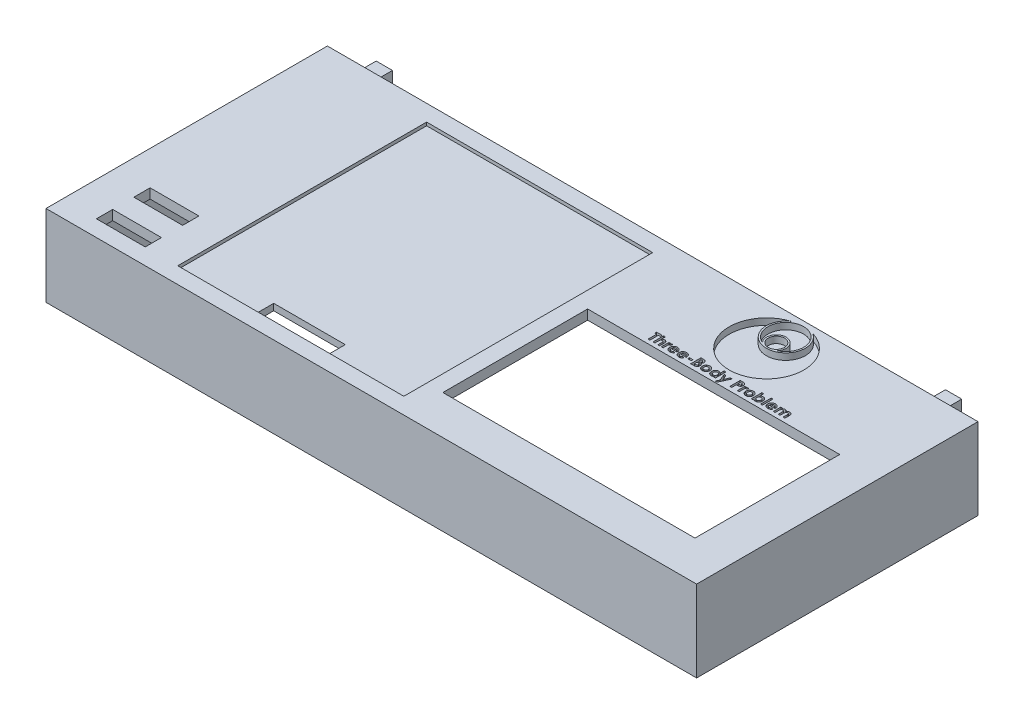
from build123d import *

# Parameters (mm, degrees)
SKETCH1_W                 = 200
SKETCH1_H                 = 86.5
BOSS_EXTRUDE1_DEPTH       = 12.5
SHELL1_T                  = -3
SKETCH5_W                 = 15
SKETCH5_H                 = 5
CUT_EXTRUDE1_DEPTH        = 30
SKETCH2_W                 = 69.5
SKETCH2_H                 = 76.5
CUT_EXTRUDE2_DEPTH        = 1
SKETCH6_W                 = 22
SKETCH6_H                 = 5
CUT_EXTRUDE3_DEPTH        = 112.564163153
SKETCH3_W                 = 77.5
SKETCH3_H                 = 44.5
CUT_EXTRUDE4_DEPTH        = 112.78355201
SKETCH9_W                 = 5
SKETCH9_H                 = 7.5
BOSS_EXTRUDE2_DEPTH       = 5
SKETCH10_W                = 75
SKETCH10_H                = 17.5
CUT_EXTRUDE5_DEPTH        = 3
F_1_0MM_DOWEL_HOLE2_D     = 11.25
F_1_0MM_DOWEL_HOLE2_DEPTH = 3
F_1_0MM_DOWEL_HOLE2_TIP   = 3.379840982
F_1_0MM_DOWEL_HOLE3_D     = 8.25
F_1_0MM_DOWEL_HOLE3_DEPTH = 3
F_1_0MM_DOWEL_HOLE3_TIP   = 2.478550053
SKETCH17_R                = 2.5
CUT_EXTRUDE7_DEPTH        = 2
SKETCH18_W                = 1.099038461
SKETCH18_H                = 0.529166666
SKETCH18_W_2              = 0.569871795
SKETCH18_H_2              = 3.256410256
CUT_EXTRUDE8_DEPTH        = 2


with BuildPart() as part:
    # Sketch1 → Boss-Extrude1 (new, symmetric)
    with BuildSketch(Plane(origin=(0, 0, 0), x_dir=(1, 0, 0), z_dir=(0, 1, 0))):
        Rectangle(SKETCH1_W, SKETCH1_H)
    extrude(amount=BOSS_EXTRUDE1_DEPTH, both=True)

    # Shell1
    shell1_openings = [part.faces().sort_by_distance(p)[0] for p in [
        (0, -12.5, 0),
    ]]
    offset(amount=SHELL1_T, openings=shell1_openings, kind=Kind.INTERSECTION)

    # Sketch5 → Cut-Extrude1 (cut)
    with BuildSketch(Plane(origin=(0, 12.5, 0), x_dir=(1, 0, 0), z_dir=(0, 1, 0))):
        with Locations((-82, -35.75)):
            Rectangle(SKETCH5_W, SKETCH5_H)
        with Locations((-82, -24.25)):
            Rectangle(SKETCH5_W, SKETCH5_H)
    extrude(amount=-CUT_EXTRUDE1_DEPTH, mode=Mode.SUBTRACT)

    # Sketch2 → Cut-Extrude2 (cut)
    with BuildSketch(Plane(origin=(0, 12.5, 0), x_dir=(1, 0, 0), z_dir=(0, 1, 0))):
        with Locations((-29.75, 0)):
            Rectangle(SKETCH2_W, SKETCH2_H)
    extrude(amount=-CUT_EXTRUDE2_DEPTH, mode=Mode.SUBTRACT)

    # Sketch6 → Cut-Extrude3 (cut, through all)
    with BuildSketch(Plane(origin=(0, 11.5, 0), x_dir=(1, 0, 0), z_dir=(0, 1, 0))):
        with Locations((-29.75, -35)):
            Rectangle(SKETCH6_W, SKETCH6_H)
    extrude(amount=-CUT_EXTRUDE3_DEPTH, mode=Mode.SUBTRACT)

    # Sketch3 → Cut-Extrude4 (cut, through all)
    with BuildSketch(Plane(origin=(0, 12.5, 0), x_dir=(1, 0, 0), z_dir=(0, 1, 0))):
        with Locations((48.75, -9)):
            Rectangle(SKETCH3_W, SKETCH3_H)
    extrude(amount=-CUT_EXTRUDE4_DEPTH, mode=Mode.SUBTRACT)

    # Sketch9 → Boss-Extrude2 (add)
    with BuildSketch(Plane(origin=(0, 0, -43.25), x_dir=(-1, 0, 0), z_dir=(0, 0, -1))):
        with Locations((-87.5, 7.25)):
            Rectangle(SKETCH9_W, SKETCH9_H)
        with Locations((-87.5, -7.25)):
            Rectangle(SKETCH9_W, SKETCH9_H)
        with Locations((87.5, -7.25)):
            Rectangle(SKETCH9_W, SKETCH9_H)
        with Locations((87.5, 7.25)):
            Rectangle(SKETCH9_W, SKETCH9_H)
    extrude(amount=BOSS_EXTRUDE2_DEPTH)

    # Sketch10 → Cut-Extrude5 (cut)
    with BuildSketch(Plane(origin=(0, 0, -43.25), x_dir=(-1, 0, 0), z_dir=(0, 0, -1))):
        with Locations((0, -3.75)):
            Rectangle(SKETCH10_W, SKETCH10_H)
    extrude(amount=-CUT_EXTRUDE5_DEPTH, mode=Mode.SUBTRACT)

    # Ø1.0mm Dowel Hole2
    with Locations(Plane.ZY.offset(100)):
        with Locations((-28.25, 0)):
            Hole(F_1_0MM_DOWEL_HOLE2_D / 2, depth=F_1_0MM_DOWEL_HOLE2_DEPTH)
            with Locations((0, 0, -(F_1_0MM_DOWEL_HOLE2_DEPTH + F_1_0MM_DOWEL_HOLE2_TIP / 2))):  # 118° drill point
                Cone(0, F_1_0MM_DOWEL_HOLE2_D / 2, F_1_0MM_DOWEL_HOLE2_TIP, mode=Mode.SUBTRACT)

    # Ø1.0mm Dowel Hole3
    with Locations(Plane.ZY.offset(100)):
        with Locations((-6.75, 0)):
            Hole(F_1_0MM_DOWEL_HOLE3_D / 2, depth=F_1_0MM_DOWEL_HOLE3_DEPTH)
            with Locations((0, 0, -(F_1_0MM_DOWEL_HOLE3_DEPTH + F_1_0MM_DOWEL_HOLE3_TIP / 2))):  # 118° drill point
                Cone(0, F_1_0MM_DOWEL_HOLE3_D / 2, F_1_0MM_DOWEL_HOLE3_TIP, mode=Mode.SUBTRACT)

    # Sketch17 → Cut-Extrude7 (cut)
    with BuildSketch(Plane(origin=(0, 12.5, 0), x_dir=(1, 0, 0), z_dir=(0, 1, 0))):
        with Locations(Location((48, 33.25, 0), (0, 0, 270))):
            Circle(SKETCH17_R)
        with BuildLine():
            ThreePointArc((50.252796354, 31.268861795), (47.76885644, 41.746856634), (45.858243199, 31.14931492))
            ThreePointArc((45.858243199, 31.14931492), (47.91841992, 36.248890577), (50.252796354, 31.268861795))
        make_face()
        with BuildLine():
            ThreePointArc((51.134850756, 41.313924898), (48, 30.249445211), (44.565455756, 41.224594679))
            ThreePointArc((44.565455756, 41.224594679), (48.15636182, 18.750508261), (51.134850756, 41.313924898))
        make_face()
    extrude(amount=-CUT_EXTRUDE7_DEPTH, mode=Mode.SUBTRACT)

    # Sketch18 → Cut-Extrude8 (cut)
    # profile 1 of 17: a face of its own
    with BuildSketch(Plane(origin=(0, 12.5, 0), x_dir=(1, 0, 0), z_dir=(0, 1, 0))):
        Polygon((26.751923077, 17.675), (28.461538462, 17.675), (28.461538462, 17.105128205), (27.891666667, 17.105128205), (27.891666667, 14.5), (27.321794872, 14.5), (27.321794872, 17.105128205), (26.751923077, 17.105128205), align=None)
    # profile 2 of 17: a face of its own
    with BuildSketch(Plane(origin=(0, 12.5, 0), x_dir=(1, 0, 0), z_dir=(0, 1, 0))):
        with BuildLine():
            Line((28.827884615, 17.756410256), (29.39775641, 17.756410256))
            Line((29.39775641, 17.756410256), (29.39775641, 16.568965345))
            add(Edge.make_bspline(
                [(29.39775641, 16.568965345), (29.42646206, 16.592310475), (29.482414347, 16.637814179), (29.570205318, 16.697094709), (29.657814705, 16.747681392), (29.746172172, 16.788678441), (29.834894391, 16.820805428), (29.924134573, 16.84358935), (30.013978626, 16.858537614), (30.074208737, 16.86010999), (30.104371995, 16.860897436)],
                knots=[0, 0, 0, 0, 1.13710654, 2.216417683, 3.252896077, 4.244436563, 5.207303112, 6.149540546, 7.073289332, 8, 8, 8, 8], degree=3))
            add(Edge.make_bspline(
                [(30.104371995, 16.860897436), (30.133236209, 16.860131548), (30.189899084, 16.858628045), (30.273026957, 16.847768032), (30.352646858, 16.82908075), (30.428954928, 16.803391841), (30.501426182, 16.768844042), (30.571003027, 16.728375658), (30.63685845, 16.679890749), (30.676927724, 16.642516216), (30.697140425, 16.623662861)],
                knots=[0, 0, 0, 0, 1.056403236, 2.073808271, 3.062028718, 4.046096703, 5.014652014, 5.995532726, 6.988858718, 8, 8, 8, 8], degree=3))
            add(Edge.make_bspline(
                [(30.697140425, 16.623662861), (30.713740388, 16.606046127), (30.747181162, 16.570557058), (30.788830755, 16.509374724), (30.824794762, 16.44273198), (30.854100301, 16.370002589), (30.87589528, 16.291152696), (30.892769014, 16.206831879), (30.902100548, 16.116119449), (30.903252188, 16.053599316), (30.903846154, 16.021354167)],
                knots=[0, 0, 0, 0, 0.887296576, 1.787466942, 2.706642908, 3.663267187, 4.658426068, 5.705361056, 6.816525637, 8, 8, 8, 8], degree=3))
            Line((30.903846154, 16.021354167), (30.903846154, 14.5))
            Line((30.903846154, 14.5), (30.333974359, 14.5))
            Line((30.333974359, 14.5), (30.333974359, 15.508723958))
            add(Edge.make_bspline(
                [(30.333974359, 15.508723958), (30.333863632, 15.540737811), (30.333651688, 15.602015629), (30.331748431, 15.690012184), (30.328640353, 15.76995369), (30.324389915, 15.841864306), (30.318455374, 15.905443504), (30.312618336, 15.961146998), (30.304427604, 16.00870778), (30.292163021, 16.060387089), (30.272203497, 16.115662281), (30.243199059, 16.174583259), (30.2044571, 16.223211176), (30.159622863, 16.263317016), (30.107784006, 16.29392731), (30.050796308, 16.316535542), (29.987685533, 16.329249852), (29.943939983, 16.330882197), (29.921198918, 16.331730769)],
                knots=[0, 0, 0, 0, 1.461461505, 2.797388094, 4.017818807, 5.113567707, 6.085313608, 6.932873269, 7.669572396, 8.286941306, 9.355291607, 10.346554054, 11.270113241, 12.175128673, 13.078071705, 14.003657132, 14.962203834, 16, 16, 16, 16], degree=3))
            add(Edge.make_bspline(
                [(29.921198918, 16.331730769), (29.891574048, 16.330572635), (29.833550399, 16.3283043), (29.75034192, 16.304954498), (29.673593044, 16.268047173), (29.604199504, 16.216895281), (29.543730397, 16.152825498), (29.493066618, 16.077729315), (29.45162642, 15.992357856), (29.43371522, 15.930103511), (29.424469151, 15.897966747)],
                knots=[0, 0, 0, 0, 0.993549393, 1.945978497, 2.879753144, 3.843180486, 4.826017097, 5.826060929, 6.877775219, 8, 8, 8, 8], degree=3))
            add(Edge.make_bspline(
                [(29.424469151, 15.897966747), (29.42216686, 15.88803374), (29.416916883, 15.865383235), (29.412896351, 15.826737584), (29.406929946, 15.780021613), (29.404860295, 15.724955375), (29.40098335, 15.661623806), (29.399589048, 15.589924438), (29.39818534, 15.509789863), (29.397903983, 15.453603532), (29.39775641, 15.424133614)],
                knots=[0, 0, 0, 0, 0.514379255, 1.17295301, 1.959069106, 2.891908278, 3.953016936, 5.163065833, 6.51201855, 8, 8, 8, 8], degree=3))
            Line((29.39775641, 15.424133614), (29.39775641, 14.5))
            Line((29.39775641, 14.5), (28.827884615, 14.5))
            Line((28.827884615, 14.5), (28.827884615, 17.756410256))
        make_face()
    # profile 3 of 17: a face of its own
    with BuildSketch(Plane(origin=(0, 12.5, 0), x_dir=(1, 0, 0), z_dir=(0, 1, 0))):
        with BuildLine():
            Line((31.392307692, 16.820192308), (31.880769231, 16.820192308))
            Line((31.880769231, 16.820192308), (31.880769231, 16.534620393))
            add(Edge.make_bspline(
                [(31.880769231, 16.534620393), (31.89458687, 16.559999247), (31.921594019, 16.609603272), (31.971208417, 16.676186851), (32.028207447, 16.732261684), (32.090542957, 16.779000626), (32.158403875, 16.815429043), (32.229973005, 16.841388882), (32.304638075, 16.85825918), (32.355572055, 16.860011685), (32.381315104, 16.860897436)],
                knots=[0, 0, 0, 0, 1.09866127, 2.147379032, 3.14564304, 4.131443017, 5.102343063, 6.064490016, 7.021754664, 8, 8, 8, 8], degree=3))
            add(Edge.make_bspline(
                [(32.381315104, 16.860897436), (32.40000777, 16.860022129), (32.438072712, 16.858239691), (32.49608904, 16.847878355), (32.554942443, 16.829143087), (32.593673053, 16.812274469), (32.613461538, 16.803655849)],
                knots=[0, 0, 0, 0, 0.931404136, 1.896671404, 2.925354185, 4, 4, 4, 4], degree=3))
            Line((32.613461538, 16.803655849), (32.436648638, 16.32091847))
            add(Edge.make_bspline(
                [(32.436648638, 16.32091847), (32.420844089, 16.328554463), (32.391137622, 16.342907192), (32.34800899, 16.35984489), (32.308867968, 16.370179446), (32.284053279, 16.371721452), (32.27255609, 16.372435897)],
                knots=[0, 0, 0, 0, 1.214386998, 2.282580073, 3.20428172, 4, 4, 4, 4], degree=3))
            add(Edge.make_bspline(
                [(32.27255609, 16.372435897), (32.261700507, 16.371962468), (32.240345706, 16.371031151), (32.208826617, 16.363050083), (32.179142198, 16.349286977), (32.14986196, 16.331655073), (32.123295788, 16.307145407), (32.096746026, 16.278771118), (32.073348953, 16.243739283), (32.048658256, 16.204747072), (32.027635011, 16.157020641), (32.009608225, 16.100045117), (31.993546214, 16.033161255), (31.982493358, 15.956013934), (31.971810329, 15.869349687), (31.965451527, 15.772532411), (31.960712232, 15.665868249), (31.960422456, 15.591412815), (31.960271434, 15.552609175)],
                knots=[0, 0, 0, 0, 0.544232178, 1.070598461, 1.618251235, 2.182094276, 2.777567932, 3.425210017, 4.127676488, 4.886675562, 5.738955394, 6.734782583, 7.883056018, 9.186093582, 10.642914445, 12.264202625, 14.053029461, 16, 16, 16, 16], degree=3))
            Line((31.960271434, 15.552609175), (31.962179487, 15.439398037))
            Line((31.962179487, 15.439398037), (31.962179487, 14.5))
            Line((31.962179487, 14.5), (31.392307692, 14.5))
            Line((31.392307692, 14.5), (31.392307692, 16.820192308))
        make_face()
    # profile 4 of 17: a face of its own
    with BuildSketch(Plane(origin=(0, 12.5, 0), x_dir=(1, 0, 0), z_dir=(0, 1, 0))):
        with BuildLine():
            Line((35.216681691, 15.517628205), (33.386858974, 15.517628205))
            add(Edge.make_bspline(
                [(33.386858974, 15.517628205), (33.390589835, 15.496366703), (33.397921271, 15.454586175), (33.413841744, 15.393896331), (33.434158656, 15.336703248), (33.458507195, 15.28293047), (33.486476846, 15.232293723), (33.519101126, 15.185030513), (33.555966227, 15.141182585), (33.596859003, 15.100940508), (33.641097848, 15.064882735), (33.688468218, 15.033293846), (33.739018997, 15.00739289), (33.79217064, 14.985561071), (33.848320311, 14.968268059), (33.907550648, 14.956341398), (33.969704642, 14.949296275), (34.012045841, 14.948277279), (34.033688902, 14.94775641)],
                knots=[0, 0, 0, 0, 1.091296461, 2.144483647, 3.168565212, 4.157007626, 5.126487748, 6.090021542, 7.05641414, 8.019231907, 8.98705074, 9.938580405, 10.892824166, 11.854447369, 12.841318655, 13.858982407, 14.905600794, 16, 16, 16, 16], degree=3))
            add(Edge.make_bspline(
                [(34.033688902, 14.94775641), (34.059813546, 14.948446126), (34.111260664, 14.94980438), (34.186631075, 14.961850072), (34.259525241, 14.98004456), (34.329253327, 15.007101292), (34.396623023, 15.040782167), (34.460525217, 15.082744392), (34.522066006, 15.131761696), (34.55961314, 15.169544214), (34.57875601, 15.188807091)],
                knots=[0, 0, 0, 0, 1.021034703, 2.010718019, 2.977989445, 3.954245119, 4.929443971, 5.918328161, 6.938689359, 8, 8, 8, 8], degree=3))
            Line((34.57875601, 15.188807091), (35.055769231, 14.961748798))
            add(Edge.make_bspline(
                [(35.055769231, 14.961748798), (35.040750748, 14.94099556), (35.010992176, 14.899873781), (34.962412307, 14.842004818), (34.91171612, 14.788010728), (34.858865806, 14.738246638), (34.803794338, 14.692854357), (34.746654911, 14.651280923), (34.686612457, 14.614642568), (34.624867512, 14.58116675), (34.560143694, 14.552468086), (34.492620124, 14.527994878), (34.422582801, 14.505871307), (34.349147306, 14.489014358), (34.272925134, 14.475670534), (34.193733948, 14.466194651), (34.111584184, 14.460341853), (34.055747468, 14.459648011), (34.027328726, 14.459294872)],
                knots=[0, 0, 0, 0, 1.028154879, 2.037251081, 3.030720504, 4.000128189, 4.949298328, 5.894184978, 6.834267904, 7.770992897, 8.712077017, 9.673380525, 10.653304757, 11.658697181, 12.695551717, 13.758623199, 14.859225354, 16, 16, 16, 16], degree=3))
            add(Edge.make_bspline(
                [(34.027328726, 14.459294872), (33.983606958, 14.460186227), (33.897980394, 14.461931895), (33.772736067, 14.478134193), (33.653788693, 14.504999348), (33.540802408, 14.541518401), (33.434265613, 14.589734992), (33.334125583, 14.648707882), (33.239381775, 14.717306444), (33.152929143, 14.796970377), (33.074168245, 14.883679833), (33.004989569, 14.976799867), (32.947101837, 15.075679886), (32.899563269, 15.17966548), (32.862614641, 15.289022811), (32.835976824, 15.403799602), (32.819647523, 15.523941033), (32.817883877, 15.605770758), (32.816987179, 15.647375801)],
                knots=[0, 0, 0, 0, 1.103565453, 2.161269334, 3.182010356, 4.179077853, 5.15417608, 6.128274628, 7.109042802, 8.101804412, 9.090965879, 10.063106201, 11.02526161, 11.978650795, 12.945248442, 13.93468508, 14.949922959, 16, 16, 16, 16], degree=3))
            add(Edge.make_bspline(
                [(32.816987179, 15.647375801), (32.817892703, 15.690038082), (32.819674279, 15.773974203), (32.835836229, 15.896889754), (32.862688286, 16.014167815), (32.899744996, 16.12596989), (32.946562399, 16.232645647), (33.005186652, 16.333261803), (33.074133915, 16.428168647), (33.152611079, 16.516922196), (33.239429951, 16.59703197), (33.331683205, 16.668425789), (33.430407401, 16.727915857), (33.534485883, 16.775983795), (33.643252928, 16.815037782), (33.75796573, 16.841024948), (33.8777515, 16.858473775), (33.959634415, 16.860080703), (34.001252003, 16.860897436)],
                knots=[0, 0, 0, 0, 1.079208495, 2.12329425, 3.130605359, 4.119693003, 5.099659317, 6.073216462, 7.060498243, 8.06384408, 9.066070512, 10.045757761, 11.010926815, 11.975797609, 12.942977511, 13.929384301, 14.947594487, 16, 16, 16, 16], degree=3))
            add(Edge.make_bspline(
                [(34.001252003, 16.860897436), (34.045183228, 16.859992252), (34.131437662, 16.858215016), (34.257554278, 16.842144278), (34.377291448, 16.815115301), (34.491159319, 16.778912022), (34.597703752, 16.729477429), (34.699265851, 16.671955769), (34.793409581, 16.601874397), (34.881138414, 16.522600313), (34.960331615, 16.434648465), (35.029555248, 16.339105819), (35.088456039, 16.236904817), (35.136195715, 16.127631011), (35.173106403, 16.011612453), (35.199768878, 15.888999814), (35.215973625, 15.759326736), (35.217704454, 15.670532148), (35.218589744, 15.625115184)],
                knots=[0, 0, 0, 0, 1.080001299, 2.120471247, 3.119684163, 4.095710327, 5.052285597, 6.002875087, 6.961153713, 7.931888285, 8.906493152, 9.865905668, 10.82813294, 11.801621613, 12.7925306, 13.817193356, 14.883530496, 16, 16, 16, 16], degree=3))
            Line((35.218589744, 15.625115184), (35.216681691, 15.517628205))
        make_face()
        with BuildLine():
            add(Edge.make_bspline(
                [(34.648717949, 15.965384615), (34.637964119, 15.994404845), (34.616582705, 16.05210462), (34.568282981, 16.131716231), (34.504190792, 16.200663119), (34.429646978, 16.261702347), (34.344476003, 16.311245596), (34.251361754, 16.347116518), (34.151481176, 16.368625172), (34.082768721, 16.37114776), (34.04768129, 16.372435897)],
                knots=[0, 0, 0, 0, 0.954238005, 1.897273737, 2.851915805, 3.847685534, 4.862635127, 5.880135777, 6.917509367, 8, 8, 8, 8], degree=3))
            add(Edge.make_bspline(
                [(34.04768129, 16.372435897), (34.009360103, 16.371198484), (33.934450161, 16.368779599), (33.826397671, 16.343053869), (33.72447446, 16.304658984), (33.664386312, 16.265073043), (33.634269832, 16.245232372)],
                knots=[0, 0, 0, 0, 1.044195649, 2.041185066, 3.018232172, 4, 4, 4, 4], degree=3))
            add(Edge.make_bspline(
                [(33.634269832, 16.245232372), (33.615479397, 16.230121282), (33.575419152, 16.197905211), (33.523392796, 16.133637207), (33.472146403, 16.055823082), (33.443010003, 15.996717757), (33.427564103, 15.965384615)],
                knots=[0, 0, 0, 0, 0.82159062, 1.751589201, 2.808063854, 4, 4, 4, 4], degree=3))
            Line((33.427564103, 15.965384615), (34.648717949, 15.965384615))
        make_face(mode=Mode.SUBTRACT)
    # profile 5 of 17: a face of its own
    with BuildSketch(Plane(origin=(0, 12.5, 0), x_dir=(1, 0, 0), z_dir=(0, 1, 0))):
        with BuildLine():
            Line((38.025335537, 15.517628205), (36.195512821, 15.517628205))
            add(Edge.make_bspline(
                [(36.195512821, 15.517628205), (36.199243681, 15.496366703), (36.206575117, 15.454586175), (36.22249559, 15.393896331), (36.242812502, 15.336703248), (36.267161041, 15.28293047), (36.295130692, 15.232293723), (36.327754972, 15.185030513), (36.364620073, 15.141182585), (36.405512849, 15.100940508), (36.449751694, 15.064882735), (36.497122064, 15.033293846), (36.547672843, 15.00739289), (36.600824486, 14.985561071), (36.656974157, 14.968268059), (36.716204494, 14.956341398), (36.778358488, 14.949296275), (36.820699687, 14.948277279), (36.842342748, 14.94775641)],
                knots=[0, 0, 0, 0, 1.091296461, 2.144483647, 3.168565212, 4.157007626, 5.126487748, 6.090021542, 7.05641414, 8.019231907, 8.98705074, 9.938580405, 10.892824166, 11.854447369, 12.841318655, 13.858982407, 14.905600794, 16, 16, 16, 16], degree=3))
            add(Edge.make_bspline(
                [(36.842342748, 14.94775641), (36.868467392, 14.948446126), (36.91991451, 14.94980438), (36.995284921, 14.961850072), (37.068179087, 14.98004456), (37.137907173, 15.007101292), (37.205276869, 15.040782167), (37.269179063, 15.082744392), (37.330719852, 15.131761696), (37.368266986, 15.169544214), (37.387409856, 15.188807091)],
                knots=[0, 0, 0, 0, 1.021034703, 2.010718019, 2.977989445, 3.954245119, 4.929443971, 5.918328161, 6.938689359, 8, 8, 8, 8], degree=3))
            Line((37.387409856, 15.188807091), (37.864423077, 14.961748798))
            add(Edge.make_bspline(
                [(37.864423077, 14.961748798), (37.849404594, 14.94099556), (37.819646023, 14.899873781), (37.771066153, 14.842004818), (37.720369966, 14.788010728), (37.667519652, 14.738246638), (37.612448184, 14.692854357), (37.555308758, 14.651280923), (37.495266303, 14.614642568), (37.433521358, 14.58116675), (37.36879754, 14.552468086), (37.30127397, 14.527994878), (37.231236647, 14.505871307), (37.157801152, 14.489014358), (37.08157898, 14.475670534), (37.002387794, 14.466194651), (36.92023803, 14.460341853), (36.864401314, 14.459648011), (36.835982572, 14.459294872)],
                knots=[0, 0, 0, 0, 1.028154879, 2.037251081, 3.030720504, 4.000128189, 4.949298328, 5.894184978, 6.834267904, 7.770992897, 8.712077017, 9.673380525, 10.653304757, 11.658697181, 12.695551717, 13.758623199, 14.859225354, 16, 16, 16, 16], degree=3))
            add(Edge.make_bspline(
                [(36.835982572, 14.459294872), (36.792260804, 14.460186227), (36.70663424, 14.461931895), (36.581389913, 14.478134193), (36.462442539, 14.504999348), (36.349456254, 14.541518401), (36.242919459, 14.589734992), (36.142779429, 14.648707882), (36.048035622, 14.717306444), (35.961582989, 14.796970377), (35.882822091, 14.883679833), (35.813643415, 14.976799867), (35.755755684, 15.075679886), (35.708217115, 15.17966548), (35.671268487, 15.289022811), (35.64463067, 15.403799602), (35.628301369, 15.523941033), (35.626537724, 15.605770758), (35.625641026, 15.647375801)],
                knots=[0, 0, 0, 0, 1.103565453, 2.161269334, 3.182010356, 4.179077853, 5.15417608, 6.128274628, 7.109042802, 8.101804412, 9.090965879, 10.063106201, 11.02526161, 11.978650795, 12.945248442, 13.93468508, 14.949922959, 16, 16, 16, 16], degree=3))
            add(Edge.make_bspline(
                [(35.625641026, 15.647375801), (35.626546549, 15.690038082), (35.628328126, 15.773974203), (35.644490075, 15.896889754), (35.671342132, 16.014167815), (35.708398842, 16.12596989), (35.755216245, 16.232645647), (35.813840498, 16.333261803), (35.882787761, 16.428168647), (35.961264925, 16.516922196), (36.048083797, 16.59703197), (36.140337051, 16.668425789), (36.239061247, 16.727915857), (36.343139729, 16.775983795), (36.451906774, 16.815037782), (36.566619576, 16.841024948), (36.686405347, 16.858473775), (36.768288261, 16.860080703), (36.809905849, 16.860897436)],
                knots=[0, 0, 0, 0, 1.079208495, 2.12329425, 3.130605359, 4.119693003, 5.099659317, 6.073216462, 7.060498243, 8.06384408, 9.066070512, 10.045757761, 11.010926815, 11.975797609, 12.942977511, 13.929384301, 14.947594487, 16, 16, 16, 16], degree=3))
            add(Edge.make_bspline(
                [(36.809905849, 16.860897436), (36.853837075, 16.859992252), (36.940091508, 16.858215016), (37.066208124, 16.842144278), (37.185945294, 16.815115301), (37.299813165, 16.778912022), (37.406357598, 16.729477429), (37.507919697, 16.671955769), (37.602063427, 16.601874397), (37.68979226, 16.522600313), (37.768985461, 16.434648465), (37.838209094, 16.339105819), (37.897109885, 16.236904817), (37.944849561, 16.127631011), (37.981760249, 16.011612453), (38.008422724, 15.888999814), (38.024627472, 15.759326736), (38.0263583, 15.670532148), (38.02724359, 15.625115184)],
                knots=[0, 0, 0, 0, 1.080001299, 2.120471247, 3.119684163, 4.095710327, 5.052285597, 6.002875087, 6.961153713, 7.931888285, 8.906493152, 9.865905668, 10.82813294, 11.801621613, 12.7925306, 13.817193356, 14.883530496, 16, 16, 16, 16], degree=3))
            Line((38.02724359, 15.625115184), (38.025335537, 15.517628205))
        make_face()
        with BuildLine():
            add(Edge.make_bspline(
                [(37.457371795, 15.965384615), (37.446617966, 15.994404845), (37.425236551, 16.05210462), (37.376936827, 16.131716231), (37.312844638, 16.200663119), (37.238300824, 16.261702347), (37.153129849, 16.311245596), (37.0600156, 16.347116518), (36.960135022, 16.368625172), (36.891422567, 16.37114776), (36.856335136, 16.372435897)],
                knots=[0, 0, 0, 0, 0.954238005, 1.897273737, 2.851915805, 3.847685534, 4.862635127, 5.880135777, 6.917509367, 8, 8, 8, 8], degree=3))
            add(Edge.make_bspline(
                [(36.856335136, 16.372435897), (36.818013949, 16.371198484), (36.743104007, 16.368779599), (36.635051517, 16.343053869), (36.533128306, 16.304658984), (36.473040158, 16.265073043), (36.442923678, 16.245232372)],
                knots=[0, 0, 0, 0, 1.044195649, 2.041185066, 3.018232172, 4, 4, 4, 4], degree=3))
            add(Edge.make_bspline(
                [(36.442923678, 16.245232372), (36.424133244, 16.230121282), (36.384072998, 16.197905211), (36.332046642, 16.133637207), (36.280800249, 16.055823082), (36.251663849, 15.996717757), (36.236217949, 15.965384615)],
                knots=[0, 0, 0, 0, 0.82159062, 1.751589201, 2.808063854, 4, 4, 4, 4], degree=3))
            Line((36.236217949, 15.965384615), (37.457371795, 15.965384615))
        make_face(mode=Mode.SUBTRACT)
    # profile 6 of 17: a face of its own
    with BuildSketch(Plane(origin=(0, 12.5, 0), x_dir=(1, 0, 0), z_dir=(0, 1, 0))):
        with Locations((39.146634616, 15.660096154)):
            Rectangle(SKETCH18_W, SKETCH18_H)
    # profile 7 of 17: a face of its own
    with BuildSketch(Plane(origin=(0, 12.5, 0), x_dir=(1, 0, 0), z_dir=(0, 1, 0))):
        with BuildLine():
            Line((40.428846154, 14.5), (40.428846154, 17.675))
            Line((40.428846154, 17.675), (40.937660256, 17.675))
            add(Edge.make_bspline(
                [(40.937660256, 17.675), (40.973280425, 17.675004065), (41.042204776, 17.675011931), (41.141644627, 17.67151993), (41.233866691, 17.667002635), (41.318577481, 17.661948833), (41.395921182, 17.653240122), (41.465780178, 17.644062092), (41.52829405, 17.632993954), (41.566942981, 17.62306549), (41.585126202, 17.618394431)],
                knots=[0, 0, 0, 0, 1.311965854, 2.538629056, 3.664479157, 4.713267157, 5.663616078, 6.530575999, 7.308677837, 8, 8, 8, 8], degree=3))
            add(Edge.make_bspline(
                [(41.585126202, 17.618394431), (41.609002618, 17.611805819), (41.655855811, 17.598876846), (41.722964535, 17.572766227), (41.786626521, 17.543742423), (41.846764039, 17.510631691), (41.903007821, 17.473034291), (41.955144122, 17.43065184), (42.004297392, 17.385185567), (42.048722312, 17.33536834), (42.088875119, 17.282727211), (42.12376071, 17.227275975), (42.154071817, 17.169862516), (42.178328642, 17.109764324), (42.196605704, 17.047258168), (42.20997347, 16.982610959), (42.218637594, 16.915618137), (42.21945624, 16.87004073), (42.219871795, 16.846905048)],
                knots=[0, 0, 0, 0, 1.099996261, 2.158545794, 3.195537121, 4.207578794, 5.205712374, 6.197378256, 7.190519799, 8.17788031, 9.159561366, 10.129234751, 11.085776129, 12.040971148, 13.00380137, 13.975669004, 14.972423361, 16, 16, 16, 16], degree=3))
            add(Edge.make_bspline(
                [(42.219871795, 16.846905048), (42.218785241, 16.817181769), (42.216646494, 16.758675147), (42.20298403, 16.672739505), (42.17736478, 16.591517971), (42.143842616, 16.513513663), (42.098262953, 16.439017538), (42.040385596, 16.368065017), (41.971147969, 16.298471365), (41.918038887, 16.256754665), (41.890414663, 16.23505609)],
                knots=[0, 0, 0, 0, 0.986156485, 1.941127874, 2.875419072, 3.804401753, 4.751181392, 5.761612777, 6.835722519, 8, 8, 8, 8], degree=3))
            add(Edge.make_bspline(
                [(41.890414663, 16.23505609), (41.912800009, 16.223628565), (41.956691478, 16.201222351), (42.019004469, 16.164393223), (42.076699497, 16.125220775), (42.130035248, 16.084493172), (42.177892945, 16.040483912), (42.222248712, 15.995728868), (42.260914265, 15.947663764), (42.295490168, 15.89800173), (42.325542981, 15.846023655), (42.351715667, 15.791817318), (42.373822796, 15.735197538), (42.392543685, 15.676452465), (42.406505729, 15.615380042), (42.415609278, 15.551958428), (42.422579525, 15.486403923), (42.423121744, 15.44174983), (42.423397436, 15.419045473)],
                knots=[0, 0, 0, 0, 1.164658916, 2.283573913, 3.35186032, 4.395461096, 5.390182219, 6.362969632, 7.312859996, 8.245001507, 9.165155236, 10.092416118, 11.032087915, 11.979892451, 12.947605196, 13.931445124, 14.948243989, 16, 16, 16, 16], degree=3))
            add(Edge.make_bspline(
                [(42.423397436, 15.419045473), (42.421608383, 15.375681448), (42.418077694, 15.290102718), (42.39226302, 15.164453489), (42.347508578, 15.045326623), (42.287412592, 14.933195582), (42.213362773, 14.831306375), (42.128226717, 14.742052315), (42.032861548, 14.666500734), (41.944875654, 14.615509278), (41.868774784, 14.581289243), (41.805741855, 14.560132259), (41.738045826, 14.540532461), (41.664446667, 14.526769079), (41.586278631, 14.514171317), (41.502779575, 14.506393198), (41.414105558, 14.501122159), (41.353200409, 14.500381615), (41.321814904, 14.5)],
                knots=[0, 0, 0, 0, 1.284142165, 2.534249414, 3.780121997, 5.041676246, 6.291546858, 7.49970053, 8.684500223, 9.883330709, 10.50184324, 11.153274765, 11.851151195, 12.587658647, 13.369265475, 14.195992086, 15.070362669, 16, 16, 16, 16], degree=3))
            Line((41.321814904, 14.5), (40.428846154, 14.5))
        make_face()
        with BuildLine():
            Line((40.998717949, 17.105128205), (40.998717949, 16.413141026))
            Line((40.998717949, 16.413141026), (41.150090144, 16.413141026))
            add(Edge.make_bspline(
                [(41.150090144, 16.413141026), (41.170662986, 16.413320429), (41.210377611, 16.413666755), (41.267741174, 16.418127321), (41.321080025, 16.425737323), (41.370191859, 16.436355191), (41.415534171, 16.449838335), (41.456817303, 16.466061461), (41.493859738, 16.485855437), (41.536894481, 16.515339439), (41.582385308, 16.558726468), (41.622430371, 16.62140802), (41.646016645, 16.693491567), (41.64864352, 16.744330466), (41.65, 16.770582933)],
                knots=[0, 0, 0, 0, 1.065314748, 2.056525647, 2.977365736, 3.853934255, 4.656397591, 5.425096493, 6.14721249, 6.826394842, 8.123232004, 9.372140726, 10.643011755, 12, 12, 12, 12], degree=3))
            add(Edge.make_bspline(
                [(41.65, 16.770582933), (41.648914568, 16.79517273), (41.646815928, 16.842716114), (41.623067582, 16.909471259), (41.586181706, 16.96862998), (41.542632744, 17.009119286), (41.501622935, 17.036772289), (41.466507819, 17.054980614), (41.427966343, 17.07128052), (41.385252384, 17.083743825), (41.338609864, 17.093095851), (41.28826535, 17.099963794), (41.234131981, 17.104638408), (41.196741948, 17.104961437), (41.177438902, 17.105128205)],
                knots=[0, 0, 0, 0, 1.347982417, 2.606269829, 3.849316587, 5.153353503, 5.842674298, 6.568177932, 7.326619318, 8.142485038, 9.012069166, 9.942760135, 10.937925643, 12, 12, 12, 12], degree=3))
            Line((41.177438902, 17.105128205), (40.998717949, 17.105128205))
        make_face(mode=Mode.SUBTRACT)
        with BuildLine():
            Line((40.998717949, 15.883974359), (40.998717949, 15.069871795))
            Line((40.998717949, 15.069871795), (41.162810497, 15.069871795))
            add(Edge.make_bspline(
                [(41.162810497, 15.069871795), (41.195251802, 15.070057131), (41.257624261, 15.070413462), (41.346972697, 15.074718795), (41.428212762, 15.082478398), (41.501129202, 15.092165637), (41.5658337, 15.105290331), (41.622107542, 15.121976697), (41.670722448, 15.140334606), (41.711386923, 15.163008804), (41.744607469, 15.189395947), (41.774585529, 15.216364242), (41.799027771, 15.247474717), (41.818366929, 15.281391887), (41.835104936, 15.317273225), (41.84520012, 15.356519883), (41.852886238, 15.397968686), (41.853309226, 15.426637926), (41.853525641, 15.44130609)],
                knots=[0, 0, 0, 0, 1.753078804, 3.370512758, 4.83203934, 6.162291463, 7.344201807, 8.395507345, 9.331626367, 10.147333109, 10.898971645, 11.62040215, 12.321813352, 13.025280112, 13.727906689, 14.453419512, 15.208716525, 16, 16, 16, 16], degree=3))
            add(Edge.make_bspline(
                [(41.853525641, 15.44130609), (41.853048384, 15.458079366), (41.852118815, 15.490749196), (41.844527018, 15.538499638), (41.830730243, 15.583077845), (41.813352532, 15.62562374), (41.789170524, 15.664614032), (41.760431033, 15.701398029), (41.725706391, 15.734730109), (41.686656506, 15.766626322), (41.641108681, 15.794553184), (41.589041547, 15.818784684), (41.530172246, 15.839021941), (41.464318424, 15.855134857), (41.391768781, 15.868809667), (41.311993782, 15.876975038), (41.225657822, 15.883047983), (41.165791063, 15.883658551), (41.134825721, 15.883974359)],
                knots=[0, 0, 0, 0, 0.845221588, 1.646264278, 2.427170338, 3.19324141, 3.95557735, 4.731569926, 5.540061037, 6.376114724, 7.268642756, 8.224665384, 9.265483498, 10.400594375, 11.639216012, 12.983232105, 14.439614077, 16, 16, 16, 16], degree=3))
            Line((41.134825721, 15.883974359), (40.998717949, 15.883974359))
        make_face(mode=Mode.SUBTRACT)
    # profile 8 of 17: a face of its own
    with BuildSketch(Plane(origin=(0, 12.5, 0), x_dir=(1, 0, 0), z_dir=(0, 1, 0))):
        with BuildLine():
            add(Edge.make_bspline(
                [(44.017257612, 16.860897436), (44.04420005, 16.860417977), (44.097558287, 16.85946843), (44.177028713, 16.851564324), (44.255109814, 16.83866845), (44.332250388, 16.821970543), (44.407734113, 16.798574278), (44.481956893, 16.770514075), (44.555582372, 16.738297682), (44.626783182, 16.699948905), (44.696073695, 16.658356158), (44.761765224, 16.612475947), (44.823312249, 16.562668643), (44.881857289, 16.510089069), (44.934672053, 16.452448081), (44.985131686, 16.392523064), (45.030509979, 16.328167113), (45.072523741, 16.260948435), (45.109928291, 16.191255742), (45.142407263, 16.11957384), (45.170595958, 16.046893784), (45.192667141, 15.97233028), (45.210940046, 15.896866546), (45.222471548, 15.819577832), (45.230669646, 15.741258087), (45.231588913, 15.688526789), (45.232051282, 15.662004207)],
                knots=[0, 0, 0, 0, 1.022364134, 2.024744242, 3.027414945, 4.024939316, 5.017584196, 6.023349371, 7.035562955, 8.064994934, 9.090267829, 10.101425541, 11.102933353, 12.093946398, 13.084502048, 14.067315274, 15.065326281, 16.070028806, 17.074376865, 18.064572984, 19.055292013, 20.030201733, 21.013838017, 21.999348303, 22.993720005, 24, 24, 24, 24], degree=3))
            add(Edge.make_bspline(
                [(45.232051282, 15.662004207), (45.231563328, 15.635274416), (45.230593165, 15.582129534), (45.222768145, 15.503073095), (45.209822909, 15.425420928), (45.193060915, 15.348715572), (45.169752205, 15.273938544), (45.142518466, 15.199987602), (45.109087979, 15.127870725), (45.072128114, 15.056801186), (45.029844221, 14.988870345), (44.984505209, 14.923869703), (44.934256925, 14.863504533), (44.881864958, 14.805902744), (44.824844239, 14.75301217), (44.764104924, 14.703974009), (44.700172847, 14.658188747), (44.63258827, 14.616730594), (44.562216837, 14.580302794), (44.490245351, 14.547460159), (44.416252961, 14.52011632), (44.340392799, 14.497818172), (44.262618858, 14.480553275), (44.183102843, 14.468825025), (44.102016002, 14.460668162), (44.047382882, 14.459755582), (44.019801683, 14.459294872)],
                knots=[0, 0, 0, 0, 1.012026251, 2.012137606, 3.004615893, 3.992048833, 4.982446996, 5.968083444, 6.973977695, 7.990229942, 8.999482246, 10.001782172, 10.988562221, 11.971415814, 12.948383116, 13.930088534, 14.925840678, 15.924049238, 16.929462851, 17.924729459, 18.917889337, 19.913673841, 20.916777188, 21.931792057, 22.95587778, 24, 24, 24, 24], degree=3))
            add(Edge.make_bspline(
                [(44.019801683, 14.459294872), (43.979472345, 14.460478617), (43.899982608, 14.462811798), (43.782913018, 14.478793474), (43.670447787, 14.506302129), (43.562403654, 14.544648588), (43.458640269, 14.593788146), (43.360063194, 14.654605811), (43.265691856, 14.725904257), (43.177160838, 14.807080864), (43.096054432, 14.896138954), (43.025198229, 14.991207921), (42.965035578, 15.090862843), (42.915620608, 15.195217359), (42.877482328, 15.304414568), (42.849939982, 15.418128009), (42.833938767, 15.536677312), (42.831625319, 15.617223129), (42.830448718, 15.658188101)],
                knots=[0, 0, 0, 0, 1.029999031, 2.030143771, 3.011211297, 3.982305373, 4.953580601, 5.938004764, 6.935448627, 7.970290061, 9.001484052, 10.007591832, 10.993831261, 11.969999897, 12.951306496, 13.942897864, 14.953773953, 16, 16, 16, 16], degree=3))
            add(Edge.make_bspline(
                [(42.830448718, 15.658188101), (42.831666351, 15.701929711), (42.834059584, 15.78790297), (42.853062907, 15.913855753), (42.883409163, 16.034449574), (42.926969303, 16.149347093), (42.98261355, 16.258760224), (43.050542566, 16.362458201), (43.131092059, 16.460464515), (43.192776841, 16.519742093), (43.22414363, 16.549884816)],
                knots=[0, 0, 0, 0, 1.043912699, 2.05178951, 3.033892, 4.007821512, 4.978932272, 5.95884105, 6.962068106, 8, 8, 8, 8], degree=3))
            add(Edge.make_bspline(
                [(43.22414363, 16.549884816), (43.252925794, 16.574869743), (43.309707047, 16.624159831), (43.401957894, 16.686676228), (43.496412351, 16.740671322), (43.594202497, 16.785065332), (43.695600944, 16.818537699), (43.800088083, 16.842902588), (43.907642188, 16.857868216), (43.980533453, 16.859882565), (44.017257612, 16.860897436)],
                knots=[0, 0, 0, 0, 1.048115528, 2.067714963, 3.060638214, 4.039924844, 5.017819947, 5.994373833, 6.98952318, 8, 8, 8, 8], degree=3))
        make_face()
        with BuildLine():
            add(Edge.make_bspline(
                [(44.029977965, 16.331730769), (44.007914093, 16.330997439), (43.964481123, 16.329553871), (43.900546651, 16.321806627), (43.840076753, 16.305927985), (43.781870386, 16.285734697), (43.726957226, 16.258729021), (43.673833396, 16.227126156), (43.625261219, 16.187579059), (43.578890133, 16.144198787), (43.536795522, 16.09602616), (43.500926917, 16.043542118), (43.468877523, 15.988754591), (43.444576093, 15.92965774), (43.424464337, 15.867866854), (43.410852941, 15.802383578), (43.401380361, 15.733939398), (43.400677156, 15.687054665), (43.400320513, 15.663276242)],
                knots=[0, 0, 0, 0, 1.030650113, 2.02884584, 2.99876339, 3.944280128, 4.900564847, 5.851248946, 6.823638398, 7.81794922, 8.81432732, 9.802856497, 10.78262424, 11.771747962, 12.779760563, 13.812642396, 14.89064281, 16, 16, 16, 16], degree=3))
            add(Edge.make_bspline(
                [(43.400320513, 15.663276242), (43.400737833, 15.638659272), (43.401553406, 15.590550131), (43.409998836, 15.520304316), (43.423925627, 15.453641502), (43.443711233, 15.390664671), (43.468594973, 15.330921782), (43.499124436, 15.274748032), (43.535621827, 15.222481174), (43.57700101, 15.174185569), (43.622309448, 15.130347114), (43.671954892, 15.092726592), (43.723858379, 15.060039352), (43.779216045, 15.033786453), (43.837241653, 15.013517085), (43.898107459, 14.998593431), (43.96213331, 14.99055329), (44.005788823, 14.989168377), (44.028069912, 14.988461538)],
                knots=[0, 0, 0, 0, 1.141730614, 2.231293227, 3.276944405, 4.297399982, 5.28939179, 6.275415646, 7.257752684, 8.24146775, 9.222424823, 10.176631434, 11.126518621, 12.063689483, 13.012557477, 13.974037417, 14.965980454, 16, 16, 16, 16], degree=3))
            add(Edge.make_bspline(
                [(44.028069912, 14.988461538), (44.050362145, 14.989088472), (44.094067863, 14.990317625), (44.158168901, 14.999522044), (44.219345532, 15.014007984), (44.277866724, 15.034451803), (44.33325933, 15.061266632), (44.385735396, 15.094110252), (44.435756561, 15.132254041), (44.481673043, 15.176919644), (44.524177052, 15.225365866), (44.561450525, 15.277908638), (44.592597646, 15.334082401), (44.618143862, 15.393533712), (44.637968254, 15.456180853), (44.651664484, 15.522256677), (44.66114213, 15.591556409), (44.661829431, 15.639074384), (44.662179487, 15.663276242)],
                knots=[0, 0, 0, 0, 1.031504075, 2.022346795, 2.991027682, 3.937587355, 4.885570121, 5.833146507, 6.798790848, 7.791235734, 8.792807298, 9.778388351, 10.766749885, 11.760164525, 12.768777521, 13.802286646, 14.880660483, 16, 16, 16, 16], degree=3))
            add(Edge.make_bspline(
                [(44.662179487, 15.663276242), (44.661756858, 15.687469642), (44.660927522, 15.73494494), (44.652481491, 15.804338399), (44.638691373, 15.870200647), (44.618650577, 15.932250458), (44.593914742, 15.991195721), (44.563364177, 16.046734719), (44.526686792, 16.098593906), (44.485106453, 16.146516136), (44.439118814, 16.189739438), (44.390335334, 16.228284131), (44.337640486, 16.260163553), (44.282022858, 16.286443576), (44.223334476, 16.306662303), (44.161641229, 16.321670533), (44.096754045, 16.329596267), (44.052469288, 16.331011832), (44.029977965, 16.331730769)],
                knots=[0, 0, 0, 0, 1.123894411, 2.205445421, 3.243160173, 4.246488011, 5.231014757, 6.210004299, 7.185865357, 8.177612767, 9.153374344, 10.115157457, 11.061423229, 12.009021698, 12.96873347, 13.94135618, 14.954456845, 16, 16, 16, 16], degree=3))
        make_face(mode=Mode.SUBTRACT)
    # profile 9 of 17: a face of its own
    with BuildSketch(Plane(origin=(0, 12.5, 0), x_dir=(1, 0, 0), z_dir=(0, 1, 0))):
        with BuildLine():
            Line((47.470833333, 17.756410256), (48.040705128, 17.756410256))
            Line((48.040705128, 17.756410256), (48.040705128, 14.5))
            Line((48.040705128, 14.5), (47.470833333, 14.5))
            Line((47.470833333, 14.5), (47.470833333, 14.753135016))
            add(Edge.make_bspline(
                [(47.470833333, 14.753135016), (47.442596396, 14.728495124), (47.387794076, 14.680673959), (47.301443354, 14.618624782), (47.214840305, 14.56744223), (47.127568799, 14.526678118), (47.03828751, 14.496578018), (46.946353648, 14.474784842), (46.850443268, 14.461932873), (46.785244712, 14.460183365), (46.752133413, 14.459294872)],
                knots=[0, 0, 0, 0, 1.129196829, 2.191548051, 3.199897424, 4.157751732, 5.089409408, 6.034969131, 7.002052659, 8, 8, 8, 8], degree=3))
            add(Edge.make_bspline(
                [(46.752133413, 14.459294872), (46.714964508, 14.460131056), (46.641516645, 14.461783403), (46.533740061, 14.479177023), (46.429671053, 14.505801836), (46.329394098, 14.543479273), (46.23309164, 14.592301846), (46.140026674, 14.650995704), (46.051794616, 14.721621354), (45.967660965, 14.801123004), (45.890628699, 14.888575384), (45.823286365, 14.982764668), (45.766521782, 15.082354988), (45.720017597, 15.187016157), (45.683436049, 15.296671359), (45.657358641, 15.411668388), (45.64197294, 15.532048314), (45.640068624, 15.614046405), (45.639102564, 15.65564403)],
                knots=[0, 0, 0, 0, 0.980476535, 1.937477201, 2.874147792, 3.812856188, 4.758993464, 5.720109578, 6.712210464, 7.737600662, 8.772720504, 9.783789959, 10.789002326, 11.793715968, 12.802552247, 13.835794126, 14.902098527, 16, 16, 16, 16], degree=3))
            add(Edge.make_bspline(
                [(45.639102564, 15.65564403), (45.640116447, 15.698718426), (45.642105292, 15.783213653), (45.656653571, 15.907206381), (45.682249753, 16.025054751), (45.717151988, 16.136922001), (45.762047652, 16.242827458), (45.816727571, 16.342944627), (45.881935614, 16.437011819), (45.957076324, 16.523427944), (46.038209835, 16.602632497), (46.125008349, 16.671586342), (46.216114527, 16.730165841), (46.311625185, 16.777989445), (46.411526683, 16.814945106), (46.515424612, 16.841962712), (46.623780206, 16.858174224), (46.697592915, 16.85998216), (46.734960937, 16.860897436)],
                knots=[0, 0, 0, 0, 1.136281865, 2.228943489, 3.287578264, 4.313574083, 5.316051562, 6.317280042, 7.318008486, 8.329309503, 9.333984563, 10.305318864, 11.248632312, 12.186624717, 13.117503092, 14.05354244, 15.014596925, 16, 16, 16, 16], degree=3))
            add(Edge.make_bspline(
                [(46.734960937, 16.860897436), (46.769553519, 16.859799923), (46.837960349, 16.857629591), (46.939009022, 16.843967893), (47.036237036, 16.818244108), (47.130825222, 16.785100901), (47.221545172, 16.74050145), (47.308884283, 16.686926832), (47.393072679, 16.623696663), (47.444585431, 16.574799809), (47.470833333, 16.549884816)],
                knots=[0, 0, 0, 0, 1.011899165, 2.001030639, 2.974036179, 3.948778736, 4.92769327, 5.924124564, 6.942254589, 8, 8, 8, 8], degree=3))
            Line((47.470833333, 16.549884816), (47.470833333, 17.756410256))
        make_face()
        with BuildLine():
            add(Edge.make_bspline(
                [(46.854532252, 16.331730769), (46.83182454, 16.331034018), (46.787318909, 16.329668432), (46.721867288, 16.321454334), (46.659315173, 16.306980729), (46.60010868, 16.285599085), (46.543365416, 16.259553127), (46.489947036, 16.226930993), (46.439412662, 16.188372324), (46.392059491, 16.144810625), (46.348890099, 16.096928353), (46.311675564, 16.04467842), (46.280049221, 15.989468665), (46.253301554, 15.93113309), (46.234156294, 15.868981407), (46.218993255, 15.803822718), (46.21112462, 15.735124712), (46.209698284, 15.688309147), (46.208974359, 15.664548277)],
                knots=[0, 0, 0, 0, 1.04836806, 2.054732945, 3.03993516, 4.00574415, 4.955904794, 5.917688631, 6.888591924, 7.88601754, 8.884115178, 9.859153345, 10.841239365, 11.818093293, 12.814750328, 13.83810466, 14.90274714, 16, 16, 16, 16], degree=3))
            add(Edge.make_bspline(
                [(46.208974359, 15.664548277), (46.209687226, 15.640571883), (46.211091923, 15.593326676), (46.219120483, 15.524049178), (46.233737893, 15.457938674), (46.255064143, 15.395529623), (46.281108441, 15.335979922), (46.312810208, 15.279564396), (46.351750277, 15.227280544), (46.394957511, 15.177891154), (46.443282125, 15.133788346), (46.494102443, 15.094629101), (46.548112631, 15.061864586), (46.604726718, 15.035384097), (46.663754136, 15.013804725), (46.725934912, 14.999513023), (46.790659906, 14.990376608), (46.834784643, 14.989104303), (46.857076322, 14.988461538)],
                knots=[0, 0, 0, 0, 1.099136573, 2.165835871, 3.191374663, 4.196217796, 5.183857741, 6.167377911, 7.154730987, 8.166690795, 9.170734848, 10.148332609, 11.103258353, 12.059567475, 13.009337315, 13.978056681, 14.978520572, 16, 16, 16, 16], degree=3))
            add(Edge.make_bspline(
                [(46.857076322, 14.988461538), (46.880206991, 14.989162196), (46.925555676, 14.990535864), (46.992075107, 14.998674999), (47.055467522, 15.013201674), (47.115469173, 15.034705733), (47.172996529, 15.060564732), (47.227530457, 15.092549405), (47.278479182, 15.131019592), (47.326100736, 15.17497509), (47.36973671, 15.223248349), (47.407465893, 15.276183457), (47.440329392, 15.332087404), (47.466175022, 15.392281961), (47.486700076, 15.455714007), (47.501426329, 15.522777213), (47.509436557, 15.593543882), (47.510828968, 15.641844891), (47.511538462, 15.66645633)],
                knots=[0, 0, 0, 0, 1.050008698, 2.058587853, 3.036635738, 3.995319155, 4.947022481, 5.895997462, 6.858296291, 7.838991643, 8.833936038, 9.806048392, 10.784806122, 11.771666913, 12.772873988, 13.80724452, 14.882696879, 16, 16, 16, 16], degree=3))
            add(Edge.make_bspline(
                [(47.511538462, 15.66645633), (47.510837784, 15.690644464), (47.509469158, 15.737890916), (47.501391783, 15.807180011), (47.486560982, 15.872926402), (47.466458367, 15.93525094), (47.440152936, 15.994011121), (47.407264571, 16.048555434), (47.369949256, 16.100773636), (47.325830169, 16.147742768), (47.278466592, 16.191379994), (47.226768583, 16.228686815), (47.172364911, 16.260838869), (47.114921318, 16.287236944), (47.053905902, 16.306587735), (46.990405154, 16.321570343), (46.923428331, 16.329663502), (46.87787238, 16.331030435), (46.854532252, 16.331730769)],
                knots=[0, 0, 0, 0, 1.106611376, 2.161533483, 3.185006901, 4.184773755, 5.152708835, 6.122342771, 7.094156588, 8.082475533, 9.064254463, 10.03606828, 10.992420271, 11.951521816, 12.920622147, 13.915721683, 14.932141191, 16, 16, 16, 16], degree=3))
        make_face(mode=Mode.SUBTRACT)
    # profile 10 of 17: a face of its own
    with BuildSketch(Plane(origin=(0, 12.5, 0), x_dir=(1, 0, 0), z_dir=(0, 1, 0))):
        Polygon((48.385426683, 16.820192308), (48.955934495, 16.820192308), (49.589408053, 15.327458934), (50.290299479, 16.820192308), (50.869711538, 16.820192308), (49.3782502, 13.645192308), (48.798838141, 13.645192308), (49.289207732, 14.688897236), align=None)
    # profile 11 of 17: a face of its own
    with BuildSketch(Plane(origin=(0, 12.5, 0), x_dir=(1, 0, 0), z_dir=(0, 1, 0))):
        with BuildLine():
            Line((52.477564103, 17.675), (53.113581731, 17.675))
            add(Edge.make_bspline(
                [(53.113581731, 17.675), (53.155138298, 17.674813984), (53.235309626, 17.67445512), (53.350923277, 17.670103418), (53.45758253, 17.662304902), (53.555262882, 17.652667169), (53.643924168, 17.639155443), (53.723677419, 17.623665308), (53.794539185, 17.604793814), (53.857308539, 17.582393613), (53.913642006, 17.55598465), (53.966951636, 17.52785722), (54.016032624, 17.494288125), (54.063362236, 17.458895298), (54.106234556, 17.418297677), (54.147324218, 17.375197093), (54.18489096, 17.327884211), (54.219108855, 17.276931741), (54.250149758, 17.223281068), (54.277269167, 17.166836279), (54.299266914, 17.107508057), (54.317720287, 17.045680187), (54.332542217, 16.981355365), (54.342408165, 16.914137987), (54.349109613, 16.84449739), (54.349700924, 16.797099955), (54.35, 16.773127003)],
                knots=[0, 0, 0, 0, 1.698747864, 3.27724071, 4.728299578, 6.070144658, 7.288476769, 8.393259625, 9.389771311, 10.283485332, 11.113357557, 11.931608583, 12.74405601, 13.541433047, 14.344816069, 15.154114104, 15.974336324, 16.810834471, 17.661136416, 18.50621059, 19.367396281, 20.244825668, 21.142564693, 22.063065223, 23.020325768, 24, 24, 24, 24], degree=3))
            add(Edge.make_bspline(
                [(54.35, 16.773127003), (54.349567274, 16.746606297), (54.348716914, 16.69448985), (54.340380646, 16.618093533), (54.326139668, 16.545256561), (54.307527453, 16.475364688), (54.281574044, 16.409567789), (54.251923492, 16.346295931), (54.215443909, 16.287323062), (54.173760153, 16.231911502), (54.128236736, 16.17961073), (54.077792935, 16.131930831), (54.023390229, 16.088546773), (53.965343536, 16.049003888), (53.903434932, 16.013381942), (53.837709087, 15.981347374), (53.767717187, 15.953924749), (53.718976934, 15.939582938), (53.694265825, 15.932311699)],
                knots=[0, 0, 0, 0, 1.102006807, 2.165578795, 3.188629044, 4.184801286, 5.166646146, 6.124351954, 7.085497154, 8.042432466, 9.003981491, 9.963833307, 10.922997304, 11.89326795, 12.880200226, 13.889073926, 14.929769137, 16, 16, 16, 16], degree=3))
            add(Edge.make_bspline(
                [(53.694265825, 15.932311699), (53.677989668, 15.928262164), (53.642730269, 15.919489569), (53.584385649, 15.910583183), (53.517149601, 15.902394308), (53.440804705, 15.895356962), (53.355306949, 15.890573206), (53.260739115, 15.886837306), (53.157058347, 15.884120921), (53.084962841, 15.884024531), (53.047435897, 15.883974359)],
                knots=[0, 0, 0, 0, 0.618981996, 1.340914327, 2.176866532, 3.120127938, 4.170906482, 5.338178032, 6.614476169, 8, 8, 8, 8], degree=3))
            Line((53.047435897, 15.883974359), (53.047435897, 14.5))
            Line((53.047435897, 14.5), (52.477564103, 14.5))
            Line((52.477564103, 14.5), (52.477564103, 17.675))
        make_face()
        with BuildLine():
            Line((53.047435897, 16.453846154), (53.249053486, 16.453846154))
            add(Edge.make_bspline(
                [(53.249053486, 16.453846154), (53.285740989, 16.454078781), (53.35324654, 16.454506819), (53.445435284, 16.460696491), (53.519519932, 16.470149371), (53.57804818, 16.483706987), (53.624261775, 16.504282464), (53.664118108, 16.528084417), (53.698303902, 16.558181333), (53.727903768, 16.592572209), (53.751567969, 16.632089049), (53.767977859, 16.676088399), (53.778637402, 16.723645784), (53.77962191, 16.756742577), (53.780128205, 16.773763021)],
                knots=[0, 0, 0, 0, 1.8619151, 3.425951444, 4.686033666, 5.651700536, 6.461346321, 7.243864085, 7.999046032, 8.762387399, 9.539336099, 10.322741239, 11.137448474, 12, 12, 12, 12], degree=3))
            add(Edge.make_bspline(
                [(53.780128205, 16.773763021), (53.779627118, 16.788633561), (53.778654887, 16.817485985), (53.771512617, 16.859127188), (53.760129894, 16.89794538), (53.743636766, 16.933535156), (53.722315056, 16.965836043), (53.696319578, 16.994835316), (53.665983903, 17.02115402), (53.642562988, 17.035084912), (53.630664063, 17.04216246)],
                knots=[0, 0, 0, 0, 1.102301479, 2.1387299, 3.123554645, 4.094223062, 5.036071848, 5.982632524, 6.975082478, 8, 8, 8, 8], degree=3))
            add(Edge.make_bspline(
                [(53.630664063, 17.04216246), (53.620584986, 17.047259738), (53.599245514, 17.058051721), (53.562902326, 17.07059819), (53.520962841, 17.081182518), (53.473143922, 17.089967409), (53.419636331, 17.096785396), (53.360449615, 17.101999451), (53.295496676, 17.104096225), (53.250325793, 17.104774724), (53.226792869, 17.105128205)],
                knots=[0, 0, 0, 0, 0.656809284, 1.390599849, 2.23162475, 3.173112763, 4.218524733, 5.370385145, 6.63003504, 8, 8, 8, 8], degree=3))
            Line((53.226792869, 17.105128205), (53.047435897, 17.105128205))
            Line((53.047435897, 17.105128205), (53.047435897, 16.453846154))
        make_face(mode=Mode.SUBTRACT)
    # profile 12 of 17: a face of its own
    with BuildSketch(Plane(origin=(0, 12.5, 0), x_dir=(1, 0, 0), z_dir=(0, 1, 0))):
        with BuildLine():
            Line((54.757051282, 16.820192308), (55.245512821, 16.820192308))
            Line((55.245512821, 16.820192308), (55.245512821, 16.534620393))
            add(Edge.make_bspline(
                [(55.245512821, 16.534620393), (55.25933046, 16.559999247), (55.286337609, 16.609603272), (55.335952007, 16.676186851), (55.392951036, 16.732261684), (55.455286547, 16.779000626), (55.523147464, 16.815429043), (55.594716595, 16.841388882), (55.669381665, 16.85825918), (55.720315645, 16.860011685), (55.746058694, 16.860897436)],
                knots=[0, 0, 0, 0, 1.09866127, 2.147379032, 3.14564304, 4.131443017, 5.102343063, 6.064490016, 7.021754664, 8, 8, 8, 8], degree=3))
            add(Edge.make_bspline(
                [(55.746058694, 16.860897436), (55.76475136, 16.860022129), (55.802816302, 16.858239691), (55.86083263, 16.847878355), (55.919686032, 16.829143087), (55.958416642, 16.812274469), (55.978205128, 16.803655849)],
                knots=[0, 0, 0, 0, 0.931404136, 1.896671404, 2.925354185, 4, 4, 4, 4], degree=3))
            Line((55.978205128, 16.803655849), (55.801392228, 16.32091847))
            add(Edge.make_bspline(
                [(55.801392228, 16.32091847), (55.785587679, 16.328554463), (55.755881212, 16.342907192), (55.71275258, 16.35984489), (55.673611558, 16.370179446), (55.648796869, 16.371721452), (55.637299679, 16.372435897)],
                knots=[0, 0, 0, 0, 1.214386998, 2.282580073, 3.20428172, 4, 4, 4, 4], degree=3))
            add(Edge.make_bspline(
                [(55.637299679, 16.372435897), (55.626444097, 16.371962468), (55.605089296, 16.371031151), (55.573570207, 16.363050083), (55.543885788, 16.349286977), (55.51460555, 16.331655073), (55.488039378, 16.307145407), (55.461489615, 16.278771118), (55.438092543, 16.243739283), (55.413401846, 16.204747072), (55.392378601, 16.157020641), (55.374351815, 16.100045117), (55.358289804, 16.033161255), (55.347236948, 15.956013934), (55.336553918, 15.869349687), (55.330195117, 15.772532411), (55.325455822, 15.665868249), (55.325166046, 15.591412815), (55.325015024, 15.552609175)],
                knots=[0, 0, 0, 0, 0.544232178, 1.070598461, 1.618251235, 2.182094276, 2.777567932, 3.425210017, 4.127676488, 4.886675562, 5.738955394, 6.734782583, 7.883056018, 9.186093582, 10.642914445, 12.264202625, 14.053029461, 16, 16, 16, 16], degree=3))
            Line((55.325015024, 15.552609175), (55.326923077, 15.439398037))
            Line((55.326923077, 15.439398037), (55.326923077, 14.5))
            Line((55.326923077, 14.5), (54.757051282, 14.5))
            Line((54.757051282, 14.5), (54.757051282, 16.820192308))
        make_face()
    # profile 13 of 17: a face of its own
    with BuildSketch(Plane(origin=(0, 12.5, 0), x_dir=(1, 0, 0), z_dir=(0, 1, 0))):
        with BuildLine():
            add(Edge.make_bspline(
                [(57.368539663, 16.860897436), (57.395482102, 16.860417977), (57.448840338, 16.85946843), (57.528310765, 16.851564324), (57.606391865, 16.83866845), (57.683532439, 16.821970543), (57.759016165, 16.798574278), (57.833238944, 16.770514075), (57.906864423, 16.738297682), (57.978065233, 16.699948905), (58.047355746, 16.658356158), (58.113047276, 16.612475947), (58.1745943, 16.562668643), (58.23313934, 16.510089069), (58.285954104, 16.452448081), (58.336413738, 16.392523064), (58.38179203, 16.328167113), (58.423805792, 16.260948435), (58.461210342, 16.191255742), (58.493689315, 16.11957384), (58.521878009, 16.046893784), (58.543949192, 15.97233028), (58.562222097, 15.896866546), (58.573753599, 15.819577832), (58.581951698, 15.741258087), (58.582870964, 15.688526789), (58.583333333, 15.662004207)],
                knots=[0, 0, 0, 0, 1.022364134, 2.024744242, 3.027414945, 4.024939316, 5.017584196, 6.023349371, 7.035562955, 8.064994934, 9.090267829, 10.101425541, 11.102933353, 12.093946398, 13.084502048, 14.067315274, 15.065326281, 16.070028806, 17.074376865, 18.064572984, 19.055292013, 20.030201733, 21.013838017, 21.999348303, 22.993720005, 24, 24, 24, 24], degree=3))
            add(Edge.make_bspline(
                [(58.583333333, 15.662004207), (58.582845379, 15.635274416), (58.581875216, 15.582129534), (58.574050196, 15.503073095), (58.56110496, 15.425420928), (58.544342966, 15.348715572), (58.521034256, 15.273938544), (58.493800517, 15.199987602), (58.460370031, 15.127870725), (58.423410165, 15.056801186), (58.381126272, 14.988870345), (58.33578726, 14.923869703), (58.285538976, 14.863504533), (58.233147009, 14.805902744), (58.17612629, 14.75301217), (58.115386975, 14.703974009), (58.051454898, 14.658188747), (57.983870321, 14.616730594), (57.913498889, 14.580302794), (57.841527402, 14.547460159), (57.767535012, 14.52011632), (57.69167485, 14.497818172), (57.613900909, 14.480553275), (57.534384894, 14.468825025), (57.453298053, 14.460668162), (57.398664933, 14.459755582), (57.371083734, 14.459294872)],
                knots=[0, 0, 0, 0, 1.012026251, 2.012137606, 3.004615893, 3.992048833, 4.982446996, 5.968083444, 6.973977695, 7.990229942, 8.999482246, 10.001782172, 10.988562221, 11.971415814, 12.948383116, 13.930088534, 14.925840678, 15.924049238, 16.929462851, 17.924729459, 18.917889337, 19.913673841, 20.916777188, 21.931792057, 22.95587778, 24, 24, 24, 24], degree=3))
            add(Edge.make_bspline(
                [(57.371083734, 14.459294872), (57.330754397, 14.460478617), (57.251264659, 14.462811798), (57.134195069, 14.478793474), (57.021729838, 14.506302129), (56.913685706, 14.544648588), (56.80992232, 14.593788146), (56.711345245, 14.654605811), (56.616973907, 14.725904257), (56.528442889, 14.807080864), (56.447336483, 14.896138954), (56.37648028, 14.991207921), (56.316317629, 15.090862843), (56.266902659, 15.195217359), (56.228764379, 15.304414568), (56.201222034, 15.418128009), (56.185220818, 15.536677312), (56.18290737, 15.617223129), (56.181730769, 15.658188101)],
                knots=[0, 0, 0, 0, 1.029999031, 2.030143771, 3.011211297, 3.982305373, 4.953580601, 5.938004764, 6.935448627, 7.970290061, 9.001484052, 10.007591832, 10.993831261, 11.969999897, 12.951306496, 13.942897864, 14.953773953, 16, 16, 16, 16], degree=3))
            add(Edge.make_bspline(
                [(56.181730769, 15.658188101), (56.182948402, 15.701929711), (56.185341635, 15.78790297), (56.204344958, 15.913855753), (56.234691214, 16.034449574), (56.278251354, 16.149347093), (56.333895602, 16.258760224), (56.401824617, 16.362458201), (56.48237411, 16.460464515), (56.544058892, 16.519742093), (56.575425681, 16.549884816)],
                knots=[0, 0, 0, 0, 1.043912699, 2.05178951, 3.033892, 4.007821512, 4.978932272, 5.95884105, 6.962068106, 8, 8, 8, 8], degree=3))
            add(Edge.make_bspline(
                [(56.575425681, 16.549884816), (56.604207846, 16.574869743), (56.660989098, 16.624159831), (56.753239945, 16.686676228), (56.847694402, 16.740671322), (56.945484548, 16.785065332), (57.046882995, 16.818537699), (57.151370134, 16.842902588), (57.258924239, 16.857868216), (57.331815505, 16.859882565), (57.368539663, 16.860897436)],
                knots=[0, 0, 0, 0, 1.048115528, 2.067714963, 3.060638214, 4.039924844, 5.017819947, 5.994373833, 6.98952318, 8, 8, 8, 8], degree=3))
        make_face()
        with BuildLine():
            add(Edge.make_bspline(
                [(57.381260016, 16.331730769), (57.359196144, 16.330997439), (57.315763174, 16.329553871), (57.251828702, 16.321806627), (57.191358805, 16.305927985), (57.133152438, 16.285734697), (57.078239277, 16.258729021), (57.025115447, 16.227126156), (56.976543271, 16.187579059), (56.930172184, 16.144198787), (56.888077573, 16.09602616), (56.852208968, 16.043542118), (56.820159575, 15.988754591), (56.795858145, 15.92965774), (56.775746388, 15.867866854), (56.762134993, 15.802383578), (56.752662412, 15.733939398), (56.751959207, 15.687054665), (56.751602564, 15.663276242)],
                knots=[0, 0, 0, 0, 1.030650113, 2.02884584, 2.99876339, 3.944280128, 4.900564847, 5.851248946, 6.823638398, 7.81794922, 8.81432732, 9.802856497, 10.78262424, 11.771747962, 12.779760563, 13.812642396, 14.89064281, 16, 16, 16, 16], degree=3))
            add(Edge.make_bspline(
                [(56.751602564, 15.663276242), (56.752019885, 15.638659272), (56.752835458, 15.590550131), (56.761280887, 15.520304316), (56.775207678, 15.453641502), (56.794993284, 15.390664671), (56.819877024, 15.330921782), (56.850406487, 15.274748032), (56.886903878, 15.222481174), (56.928283061, 15.174185569), (56.973591499, 15.130347114), (57.023236944, 15.092726592), (57.07514043, 15.060039352), (57.130498096, 15.033786453), (57.188523705, 15.013517085), (57.24938951, 14.998593431), (57.313415362, 14.99055329), (57.357070874, 14.989168377), (57.379351963, 14.988461538)],
                knots=[0, 0, 0, 0, 1.141730614, 2.231293227, 3.276944405, 4.297399982, 5.28939179, 6.275415646, 7.257752684, 8.24146775, 9.222424823, 10.176631434, 11.126518621, 12.063689483, 13.012557477, 13.974037417, 14.965980454, 16, 16, 16, 16], degree=3))
            add(Edge.make_bspline(
                [(57.379351963, 14.988461538), (57.401644196, 14.989088472), (57.445349914, 14.990317625), (57.509450952, 14.999522044), (57.570627583, 15.014007984), (57.629148776, 15.034451803), (57.684541381, 15.061266632), (57.737017447, 15.094110252), (57.787038612, 15.132254041), (57.832955094, 15.176919644), (57.875459103, 15.225365866), (57.912732577, 15.277908638), (57.943879697, 15.334082401), (57.969425913, 15.393533712), (57.989250305, 15.456180853), (58.002946536, 15.522256677), (58.012424181, 15.591556409), (58.013111482, 15.639074384), (58.013461538, 15.663276242)],
                knots=[0, 0, 0, 0, 1.031504075, 2.022346795, 2.991027682, 3.937587355, 4.885570121, 5.833146507, 6.798790848, 7.791235734, 8.792807298, 9.778388351, 10.766749885, 11.760164525, 12.768777521, 13.802286646, 14.880660483, 16, 16, 16, 16], degree=3))
            add(Edge.make_bspline(
                [(58.013461538, 15.663276242), (58.013038909, 15.687469642), (58.012209573, 15.73494494), (58.003763542, 15.804338399), (57.989973424, 15.870200647), (57.969932628, 15.932250458), (57.945196793, 15.991195721), (57.914646228, 16.046734719), (57.877968844, 16.098593906), (57.836388505, 16.146516136), (57.790400865, 16.189739438), (57.741617385, 16.228284131), (57.688922538, 16.260163553), (57.633304909, 16.286443576), (57.574616527, 16.306662303), (57.51292328, 16.321670533), (57.448036097, 16.329596267), (57.40375134, 16.331011832), (57.381260016, 16.331730769)],
                knots=[0, 0, 0, 0, 1.123894411, 2.205445421, 3.243160173, 4.246488011, 5.231014757, 6.210004299, 7.185865357, 8.177612767, 9.153374344, 10.115157457, 11.061423229, 12.009021698, 12.96873347, 13.94135618, 14.954456845, 16, 16, 16, 16], degree=3))
        make_face(mode=Mode.SUBTRACT)
    # profile 14 of 17: a face of its own
    with BuildSketch(Plane(origin=(0, 12.5, 0), x_dir=(1, 0, 0), z_dir=(0, 1, 0))):
        with BuildLine():
            Line((59.641666667, 17.756410256), (59.641666667, 16.549884816))
            add(Edge.make_bspline(
                [(59.641666667, 16.549884816), (59.668128907, 16.574800609), (59.720075692, 16.623711639), (59.804890213, 16.686958954), (59.892747955, 16.74033917), (59.98357021, 16.785122673), (60.078174387, 16.818238143), (60.175398102, 16.843970104), (60.27623758, 16.857598293), (60.344431057, 16.859791647), (60.378811098, 16.860897436)],
                knots=[0, 0, 0, 0, 1.061187343, 2.083167259, 3.083809127, 4.061667593, 5.035358583, 6.007314429, 6.995378812, 8, 8, 8, 8], degree=3))
            add(Edge.make_bspline(
                [(60.378811098, 16.860897436), (60.416182669, 16.860002293), (60.489792537, 16.858239151), (60.598095452, 16.841777688), (60.701884241, 16.815168866), (60.801554677, 16.778015699), (60.896575727, 16.729778516), (60.988015021, 16.672023597), (61.07429558, 16.602367658), (61.155459348, 16.523470627), (61.230537856, 16.436993621), (61.295842331, 16.342974761), (61.350238424, 16.242651517), (61.396341786, 16.137209919), (61.429989871, 16.024901252), (61.455923008, 15.907232063), (61.470374407, 15.783206845), (61.472376698, 15.698716127), (61.473397436, 15.65564403)],
                knots=[0, 0, 0, 0, 0.985987466, 1.942075377, 2.884088208, 3.810275091, 4.743821533, 5.692411115, 6.659945104, 7.665215984, 8.677116751, 9.678438675, 10.680260931, 11.685531812, 12.710472044, 13.769734641, 14.863044265, 16, 16, 16, 16], degree=3))
            add(Edge.make_bspline(
                [(61.473397436, 15.65564403), (61.472431376, 15.614046406), (61.470527058, 15.532048317), (61.455141369, 15.411668375), (61.429063915, 15.296671405), (61.392482532, 15.187015991), (61.345977739, 15.082355604), (61.289215429, 14.982762361), (61.221864495, 14.888584137), (61.144864998, 14.80108961), (61.060731857, 14.721856812), (60.973071155, 14.650769238), (60.880136979, 14.592518547), (60.784252476, 14.543321375), (60.6839071, 14.50570125), (60.579786255, 14.479344124), (60.472054844, 14.46172275), (60.398810605, 14.460112225), (60.361638622, 14.459294872)],
                knots=[0, 0, 0, 0, 1.098553145, 2.165490463, 3.199345634, 4.208780719, 5.21409072, 6.219899742, 7.23156933, 8.267303578, 9.293302409, 10.281606823, 11.243293419, 12.184993323, 13.124258899, 14.066907486, 15.018941492, 16, 16, 16, 16], degree=3))
            add(Edge.make_bspline(
                [(60.361638622, 14.459294872), (60.328526744, 14.46018004), (60.263327049, 14.461923), (60.167219984, 14.474850132), (60.074864585, 14.496591078), (59.985094182, 14.526539371), (59.8976652, 14.567457545), (59.81105506, 14.618620368), (59.724706358, 14.680675169), (59.669903752, 14.728495535), (59.641666667, 14.753135016)],
                knots=[0, 0, 0, 0, 0.996418773, 1.962021009, 2.912343664, 3.848616743, 4.805003894, 5.811808768, 6.872532775, 8, 8, 8, 8], degree=3))
            Line((59.641666667, 14.753135016), (59.641666667, 14.5))
            Line((59.641666667, 14.5), (59.071794872, 14.5))
            Line((59.071794872, 14.5), (59.071794872, 17.756410256))
            Line((59.071794872, 17.756410256), (59.641666667, 17.756410256))
        make_face()
        with BuildLine():
            add(Edge.make_bspline(
                [(60.255423678, 16.331730769), (60.23229658, 16.331019595), (60.186954897, 16.329625307), (60.120385047, 16.321634649), (60.057308943, 16.306600168), (59.996767562, 16.28711394), (59.939527533, 16.260810594), (59.885120568, 16.228925531), (59.834012668, 16.190905027), (59.785938583, 16.148254648), (59.742740196, 16.100272891), (59.704362177, 16.049001896), (59.672522497, 15.993774016), (59.645980654, 15.935289535), (59.625955993, 15.872915658), (59.611103496, 15.807182999), (59.603032105, 15.737890117), (59.601662643, 15.690644193), (59.600961538, 15.66645633)],
                knots=[0, 0, 0, 0, 1.060469436, 2.079096586, 3.066888298, 4.028858836, 4.99004353, 5.948472697, 6.914558426, 7.905691313, 8.889602648, 9.869280844, 10.836099585, 11.806137001, 12.808075328, 13.83377171, 14.890985086, 16, 16, 16, 16], degree=3))
            add(Edge.make_bspline(
                [(59.600961538, 15.66645633), (59.601671465, 15.641845159), (59.603064728, 15.593544677), (59.611068833, 15.522774218), (59.625817081, 15.45572463), (59.646263499, 15.392243895), (59.672353697, 15.332323778), (59.704155652, 15.275742145), (59.742956115, 15.223739519), (59.785679951, 15.17449269), (59.83405129, 15.13127164), (59.884928948, 15.092508303), (59.939514315, 15.060575712), (59.997027896, 15.034702765), (60.057033282, 15.013202488), (60.120424669, 14.998674773), (60.186944383, 14.990535924), (60.232293029, 14.989162216), (60.255423678, 14.988461538)],
                knots=[0, 0, 0, 0, 1.117193555, 2.192540452, 3.22680955, 4.227918444, 5.21468246, 6.188555072, 7.166222992, 8.154674427, 9.142376254, 10.104580718, 11.053462639, 12.005072638, 12.963662044, 13.941614018, 14.950094269, 16, 16, 16, 16], degree=3))
            add(Edge.make_bspline(
                [(60.255423678, 14.988461538), (60.277712956, 14.989112446), (60.321832942, 14.990400871), (60.386387956, 14.999391043), (60.448441407, 15.014081878), (60.507507336, 15.035021632), (60.563945298, 15.06228517), (60.61826909, 15.094188023), (60.668603249, 15.134048256), (60.71692247, 15.177858054), (60.760155263, 15.227262907), (60.798940274, 15.279749056), (60.831520836, 15.335784951), (60.857389035, 15.395556415), (60.878775012, 15.457931289), (60.893375893, 15.524051251), (60.901409031, 15.593326131), (60.902813095, 15.640571699), (60.903525641, 15.664548277)],
                knots=[0, 0, 0, 0, 1.021711385, 2.02240246, 2.981887075, 3.941027022, 4.888772411, 5.852236371, 6.822344989, 7.82661704, 8.838806642, 9.826383926, 10.814965113, 11.80282933, 12.807900643, 13.833672313, 14.900613836, 16, 16, 16, 16], degree=3))
            add(Edge.make_bspline(
                [(60.903525641, 15.664548277), (60.902801716, 15.688309147), (60.90137538, 15.735124712), (60.893506745, 15.803822718), (60.878343707, 15.868981408), (60.859198442, 15.931133083), (60.832450791, 15.989468689), (60.800824391, 16.044678327), (60.763610071, 16.096928699), (60.720439857, 16.1448093), (60.673089741, 16.188377207), (60.622544298, 16.22691338), (60.569002026, 16.259718643), (60.511733795, 16.285589308), (60.452091046, 16.306875291), (60.389162312, 16.321537357), (60.323267519, 16.329652165), (60.278342026, 16.331028595), (60.255423678, 16.331730769)],
                knots=[0, 0, 0, 0, 1.094680664, 2.156827393, 3.177782763, 4.17210342, 5.146667393, 6.126451192, 7.099203661, 8.094961544, 9.09004898, 10.058676268, 11.018205477, 11.974998356, 12.947750825, 13.930643515, 14.944335875, 16, 16, 16, 16], degree=3))
        make_face(mode=Mode.SUBTRACT)
    # profile 15 of 17: a face of its own
    with BuildSketch(Plane(origin=(0, 12.5, 0), x_dir=(1, 0, 0), z_dir=(0, 1, 0))):
        with Locations((62.206089744, 16.128205128)):
            Rectangle(SKETCH18_W_2, SKETCH18_H_2)
    # profile 16 of 17: a face of its own
    with BuildSketch(Plane(origin=(0, 12.5, 0), x_dir=(1, 0, 0), z_dir=(0, 1, 0))):
        with BuildLine():
            Line((65.338476562, 15.517628205), (63.508653846, 15.517628205))
            add(Edge.make_bspline(
                [(63.508653846, 15.517628205), (63.512384707, 15.496366703), (63.519716143, 15.454586175), (63.535636616, 15.393896331), (63.555953528, 15.336703248), (63.580302067, 15.28293047), (63.608271718, 15.232293723), (63.640895998, 15.185030513), (63.677761098, 15.141182585), (63.718653875, 15.100940508), (63.762892719, 15.064882735), (63.81026309, 15.033293846), (63.860813869, 15.00739289), (63.913965511, 14.985561071), (63.970115182, 14.968268059), (64.02934552, 14.956341398), (64.091499514, 14.949296275), (64.133840713, 14.948277279), (64.155483774, 14.94775641)],
                knots=[0, 0, 0, 0, 1.091296461, 2.144483647, 3.168565212, 4.157007626, 5.126487748, 6.090021542, 7.05641414, 8.019231907, 8.98705074, 9.938580405, 10.892824166, 11.854447369, 12.841318655, 13.858982407, 14.905600794, 16, 16, 16, 16], degree=3))
            add(Edge.make_bspline(
                [(64.155483774, 14.94775641), (64.181608418, 14.948446126), (64.233055536, 14.94980438), (64.308425947, 14.961850072), (64.381320113, 14.98004456), (64.451048199, 15.007101292), (64.518417895, 15.040782167), (64.582320089, 15.082744392), (64.643860878, 15.131761696), (64.681408012, 15.169544214), (64.700550881, 15.188807091)],
                knots=[0, 0, 0, 0, 1.021034703, 2.010718019, 2.977989445, 3.954245119, 4.929443971, 5.918328161, 6.938689359, 8, 8, 8, 8], degree=3))
            Line((64.700550881, 15.188807091), (65.177564103, 14.961748798))
            add(Edge.make_bspline(
                [(65.177564103, 14.961748798), (65.16254562, 14.94099556), (65.132787048, 14.899873781), (65.084207179, 14.842004818), (65.033510992, 14.788010728), (64.980660678, 14.738246638), (64.92558921, 14.692854357), (64.868449783, 14.651280923), (64.808407328, 14.614642568), (64.746662383, 14.58116675), (64.681938566, 14.552468086), (64.614414996, 14.527994878), (64.544377673, 14.505871307), (64.470942177, 14.489014358), (64.394720006, 14.475670534), (64.315528819, 14.466194651), (64.233379056, 14.460341853), (64.17754234, 14.459648011), (64.149123598, 14.459294872)],
                knots=[0, 0, 0, 0, 1.028154879, 2.037251081, 3.030720504, 4.000128189, 4.949298328, 5.894184978, 6.834267904, 7.770992897, 8.712077017, 9.673380525, 10.653304757, 11.658697181, 12.695551717, 13.758623199, 14.859225354, 16, 16, 16, 16], degree=3))
            add(Edge.make_bspline(
                [(64.149123598, 14.459294872), (64.105401829, 14.460186227), (64.019775266, 14.461931895), (63.894530938, 14.478134193), (63.775583565, 14.504999348), (63.662597279, 14.541518401), (63.556060484, 14.589734992), (63.455920454, 14.648707882), (63.361176647, 14.717306444), (63.274724015, 14.796970377), (63.195963117, 14.883679833), (63.12678444, 14.976799867), (63.068896709, 15.075679886), (63.02135814, 15.17966548), (62.984409513, 15.289022811), (62.957771696, 15.403799602), (62.941442395, 15.523941033), (62.939678749, 15.605770758), (62.938782051, 15.647375801)],
                knots=[0, 0, 0, 0, 1.103565453, 2.161269334, 3.182010356, 4.179077853, 5.15417608, 6.128274628, 7.109042802, 8.101804412, 9.090965879, 10.063106201, 11.02526161, 11.978650795, 12.945248442, 13.93468508, 14.949922959, 16, 16, 16, 16], degree=3))
            add(Edge.make_bspline(
                [(62.938782051, 15.647375801), (62.939687575, 15.690038082), (62.941469151, 15.773974203), (62.957631101, 15.896889754), (62.984483157, 16.014167815), (63.021539868, 16.12596989), (63.068357271, 16.232645647), (63.126981524, 16.333261803), (63.195928787, 16.428168647), (63.274405951, 16.516922196), (63.361224823, 16.59703197), (63.453478077, 16.668425789), (63.552202273, 16.727915857), (63.656280755, 16.775983795), (63.7650478, 16.815037782), (63.879760602, 16.841024948), (63.999546372, 16.858473775), (64.081429287, 16.860080703), (64.123046875, 16.860897436)],
                knots=[0, 0, 0, 0, 1.079208495, 2.12329425, 3.130605359, 4.119693003, 5.099659317, 6.073216462, 7.060498243, 8.06384408, 9.066070512, 10.045757761, 11.010926815, 11.975797609, 12.942977511, 13.929384301, 14.947594487, 16, 16, 16, 16], degree=3))
            add(Edge.make_bspline(
                [(64.123046875, 16.860897436), (64.1669781, 16.859992252), (64.253232534, 16.858215016), (64.37934915, 16.842144278), (64.499086319, 16.815115301), (64.61295419, 16.778912022), (64.719498623, 16.729477429), (64.821060722, 16.671955769), (64.915204453, 16.601874397), (65.002933286, 16.522600313), (65.082126487, 16.434648465), (65.151350119, 16.339105819), (65.210250911, 16.236904817), (65.257990587, 16.127631011), (65.294901275, 16.011612453), (65.32156375, 15.888999814), (65.337768497, 15.759326736), (65.339499325, 15.670532148), (65.340384615, 15.625115184)],
                knots=[0, 0, 0, 0, 1.080001299, 2.120471247, 3.119684163, 4.095710327, 5.052285597, 6.002875087, 6.961153713, 7.931888285, 8.906493152, 9.865905668, 10.82813294, 11.801621613, 12.7925306, 13.817193356, 14.883530496, 16, 16, 16, 16], degree=3))
            Line((65.340384615, 15.625115184), (65.338476562, 15.517628205))
        make_face()
        with BuildLine():
            add(Edge.make_bspline(
                [(64.770512821, 15.965384615), (64.759758991, 15.994404845), (64.738377577, 16.05210462), (64.690077853, 16.131716231), (64.625985664, 16.200663119), (64.55144185, 16.261702347), (64.466270875, 16.311245596), (64.373156626, 16.347116518), (64.273276048, 16.368625172), (64.204563593, 16.37114776), (64.169476162, 16.372435897)],
                knots=[0, 0, 0, 0, 0.954238005, 1.897273737, 2.851915805, 3.847685534, 4.862635127, 5.880135777, 6.917509367, 8, 8, 8, 8], degree=3))
            add(Edge.make_bspline(
                [(64.169476162, 16.372435897), (64.131154975, 16.371198484), (64.056245033, 16.368779599), (63.948192542, 16.343053869), (63.846269332, 16.304658984), (63.786181184, 16.265073043), (63.756064704, 16.245232372)],
                knots=[0, 0, 0, 0, 1.044195649, 2.041185066, 3.018232172, 4, 4, 4, 4], degree=3))
            add(Edge.make_bspline(
                [(63.756064704, 16.245232372), (63.737274269, 16.230121282), (63.697214024, 16.197905211), (63.645187668, 16.133637207), (63.593941275, 16.055823082), (63.564804874, 15.996717757), (63.549358974, 15.965384615)],
                knots=[0, 0, 0, 0, 0.82159062, 1.751589201, 2.808063854, 4, 4, 4, 4], degree=3))
            Line((63.549358974, 15.965384615), (64.770512821, 15.965384615))
        make_face(mode=Mode.SUBTRACT)
    # profile 17 of 17: a face of its own
    with BuildSketch(Plane(origin=(0, 12.5, 0), x_dir=(1, 0, 0), z_dir=(0, 1, 0))):
        with BuildLine():
            Line((65.828846154, 16.820192308), (66.398717949, 16.820192308))
            Line((66.398717949, 16.820192308), (66.398717949, 16.542888622))
            add(Edge.make_bspline(
                [(66.398717949, 16.542888622), (66.424065557, 16.568471642), (66.473972913, 16.618842507), (66.556679166, 16.683598782), (66.642950162, 16.738973398), (66.73383137, 16.783802634), (66.829100497, 16.818032993), (66.928306017, 16.843116496), (67.031957492, 16.857914977), (67.102530138, 16.859892263), (67.13840645, 16.860897436)],
                knots=[0, 0, 0, 0, 1.041528618, 2.050684245, 3.032913108, 4.004406485, 4.976926473, 5.95771665, 6.961784757, 8, 8, 8, 8], degree=3))
            add(Edge.make_bspline(
                [(67.13840645, 16.860897436), (67.174330132, 16.859767476), (67.245044738, 16.857543187), (67.348216857, 16.837188856), (67.445955955, 16.804119945), (67.537186673, 16.756984276), (67.622568373, 16.698774176), (67.69831859, 16.626482326), (67.766502888, 16.542986508), (67.802847743, 16.479862772), (67.821489383, 16.447485978)],
                knots=[0, 0, 0, 0, 1.023965777, 2.015643508, 2.987309376, 3.958410333, 4.93654923, 5.924956801, 6.93568961, 8, 8, 8, 8], degree=3))
            add(Edge.make_bspline(
                [(67.821489383, 16.447485978), (67.845502224, 16.47995085), (67.892632692, 16.543670283), (67.976175739, 16.626863228), (68.066510698, 16.698781714), (68.165385343, 16.757414024), (68.270173905, 16.803959055), (68.380417843, 16.837065986), (68.495117649, 16.857509169), (68.573177161, 16.859758631), (68.612695312, 16.860897436)],
                knots=[0, 0, 0, 0, 1.041189987, 2.043563759, 3.033412161, 4.015238574, 5.00275396, 5.986226558, 6.980513695, 8, 8, 8, 8], degree=3))
            add(Edge.make_bspline(
                [(68.612695312, 16.860897436), (68.65351287, 16.859714962), (68.733001269, 16.857412205), (68.848191374, 16.834757106), (68.956080846, 16.799751579), (69.054285358, 16.74880997), (69.143084999, 16.688467616), (69.218753006, 16.617170607), (69.281550538, 16.5374068), (69.322439784, 16.462926867), (69.348873583, 16.397078077), (69.364834546, 16.339777292), (69.379762984, 16.275793717), (69.390487573, 16.204267325), (69.400498504, 16.125870407), (69.406310243, 16.040081755), (69.410260542, 15.947190371), (69.410680114, 15.882919328), (69.410897436, 15.849629407)],
                knots=[0, 0, 0, 0, 1.321991808, 2.574456155, 3.791773975, 4.987670122, 6.148905103, 7.262530793, 8.344737981, 9.427709016, 10.004683293, 10.642050061, 11.354108788, 12.133887687, 12.985666279, 13.916212488, 14.92067847, 16, 16, 16, 16], degree=3))
            Line((69.410897436, 15.849629407), (69.410897436, 14.5))
            Line((69.410897436, 14.5), (68.841025641, 14.5))
            Line((68.841025641, 14.5), (68.841025641, 15.665184295))
            add(Edge.make_bspline(
                [(68.841025641, 15.665184295), (68.840551331, 15.696350809), (68.839640935, 15.756172116), (68.835770492, 15.841974361), (68.827106784, 15.919789592), (68.816951808, 15.990048834), (68.802419841, 16.052379563), (68.784700747, 16.106932037), (68.764146705, 16.153784781), (68.739328319, 16.192932913), (68.711531698, 16.225901823), (68.680611967, 16.254162708), (68.646891511, 16.278274836), (68.610064605, 16.298826998), (68.569166478, 16.312726832), (68.525577788, 16.323633137), (68.478957438, 16.33106041), (68.446724139, 16.331503202), (68.430158253, 16.331730769)],
                knots=[0, 0, 0, 0, 1.669139205, 3.203761885, 4.596586177, 5.860166715, 7.002923539, 8.018877315, 8.928339525, 9.734594377, 10.491888885, 11.231098709, 11.971440889, 12.708030942, 13.480072485, 14.275788656, 15.113863979, 16, 16, 16, 16], degree=3))
            add(Edge.make_bspline(
                [(68.430158253, 16.331730769), (68.404630458, 16.330848207), (68.354537241, 16.329116355), (68.281541213, 16.312566566), (68.212851413, 16.285509433), (68.148725181, 16.2487006), (68.090542372, 16.202727063), (68.039647142, 16.148198064), (67.997614779, 16.084799348), (67.968518954, 16.025978058), (67.950337717, 15.972791791), (67.937512508, 15.927242025), (67.927515766, 15.875731978), (67.919691245, 15.818783326), (67.91218453, 15.756074133), (67.908501778, 15.687683698), (67.904733199, 15.613707031), (67.904782258, 15.562579636), (67.904807692, 15.536072716)],
                knots=[0, 0, 0, 0, 1.129913425, 2.217230253, 3.297175357, 4.391411011, 5.481605898, 6.571841268, 7.681894157, 8.841607612, 9.468549532, 10.170608623, 10.93710061, 11.791434153, 12.717934886, 13.734733707, 14.825576123, 16, 16, 16, 16], degree=3))
            Line((67.904807692, 15.536072716), (67.904807692, 14.5))
            Line((67.904807692, 14.5), (67.334935897, 14.5))
            Line((67.334935897, 14.5), (67.334935897, 15.612394832))
            add(Edge.make_bspline(
                [(67.334935897, 15.612394832), (67.334888051, 15.637202701), (67.334796009, 15.684925006), (67.33202943, 15.753836928), (67.328365938, 15.817467637), (67.323230149, 15.875994611), (67.317307028, 15.929345058), (67.3087586, 15.977227111), (67.299777686, 16.019904618), (67.284379789, 16.068384992), (67.262682173, 16.122109359), (67.230265616, 16.179081059), (67.191069572, 16.226781432), (67.146084717, 16.265581687), (67.095249901, 16.295144368), (67.039852928, 16.317135329), (66.978836027, 16.329005374), (66.936836072, 16.330803133), (66.915164263, 16.331730769)],
                knots=[0, 0, 0, 0, 1.256487322, 2.417074606, 3.49288742, 4.484586665, 5.393016842, 6.210437544, 6.947749329, 7.599905853, 8.784490193, 9.876739139, 10.906602197, 11.896672079, 12.869113195, 13.872201355, 14.902064413, 16, 16, 16, 16], degree=3))
            add(Edge.make_bspline(
                [(66.915164263, 16.331730769), (66.890676984, 16.330899629), (66.842179722, 16.329253547), (66.771536053, 16.311573291), (66.703994153, 16.285012605), (66.641039876, 16.247177118), (66.583733594, 16.200121683), (66.533347934, 16.144041653), (66.491536468, 16.079003548), (66.462311491, 16.018559755), (66.444395359, 15.964046565), (66.431225298, 15.917314056), (66.421600499, 15.864669641), (66.413570091, 15.806704423), (66.406107818, 15.743349981), (66.402409828, 15.674327705), (66.398644973, 15.599714103), (66.398693037, 15.548163116), (66.398717949, 15.521444311)],
                knots=[0, 0, 0, 0, 1.07893236, 2.136834559, 3.195274846, 4.273923004, 5.364443877, 6.458052972, 7.587287137, 8.767908, 9.410170275, 10.118584836, 10.909717261, 11.770069756, 12.702352573, 13.724628867, 14.820678298, 16, 16, 16, 16], degree=3))
            Line((66.398717949, 15.521444311), (66.398717949, 14.5))
            Line((66.398717949, 14.5), (65.828846154, 14.5))
            Line((65.828846154, 14.5), (65.828846154, 16.820192308))
        make_face()
    extrude(amount=-CUT_EXTRUDE8_DEPTH, mode=Mode.SUBTRACT)


solid = part.part
